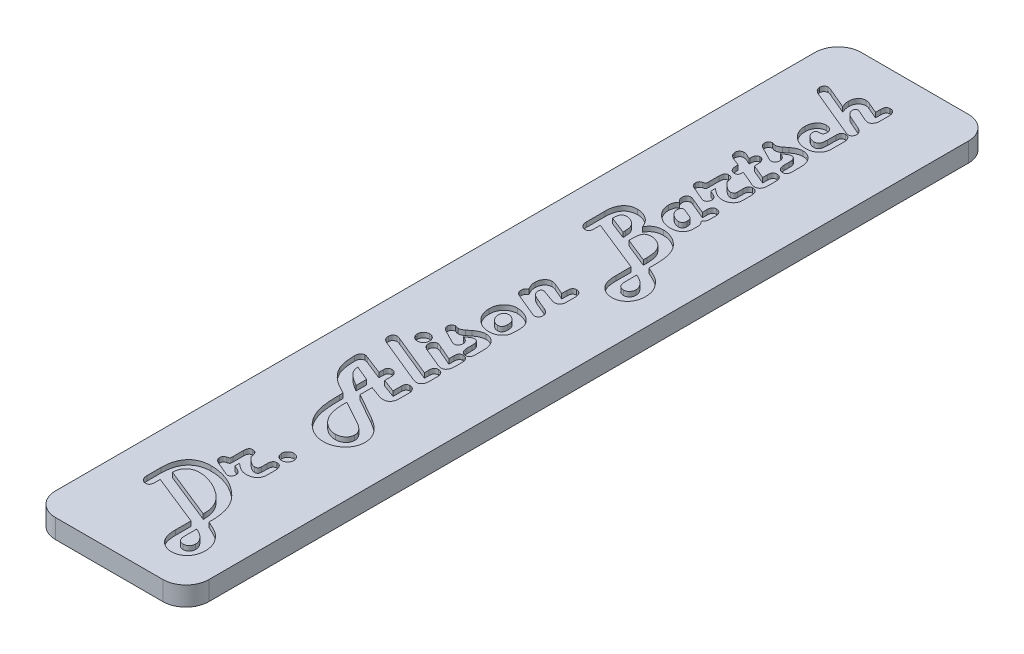
from build123d import *

# Parameters (mm, degrees)
BOSS_EXTRUDE1_DEPTH      = 66.675
BOSS_EXTRUDE1_DEPTH_BACK = 66.675
SKETCH3_W                = 25.4
SKETCH3_H                = 3.175
SKETCH5_OUTSIDE_W        = 54.556
SKETCH5_OUTSIDE_H        = 162.506
CUT_EXTRUDE2_DEPTH       = 68.947967225
CUT_EXTRUDE1_DEPTH       = 0.79375


with BuildPart() as part:
    # Sketch3 → Boss-Extrude1 (new, two sides: drawn at the far end of the back side and taken through both)
    with BuildSketch(Plane.XY.offset(-BOSS_EXTRUDE1_DEPTH_BACK)):
        Rectangle(SKETCH3_W, SKETCH3_H)
    extrude(amount=BOSS_EXTRUDE1_DEPTH + BOSS_EXTRUDE1_DEPTH_BACK)

    # Sketch5 outside → Cut-Extrude2 (cut, through all)
    with BuildSketch(Plane(origin=(0, 1.5875, 0), x_dir=(1, 0, 0), z_dir=(0, 1, 0))):
        Rectangle(SKETCH5_OUTSIDE_W, SKETCH5_OUTSIDE_H)
        with BuildLine():
            Line((12.7, -62.865), (12.7, 62.865))
            ThreePointArc((12.7, 62.865), (11.584076836, 65.559076836), (8.89, 66.675))
            Line((8.89, 66.675), (-8.89, 66.675))
            ThreePointArc((-8.89, 66.675), (-11.584076836, 65.559076836), (-12.7, 62.865))
            Line((-12.7, 62.865), (-12.7, -62.865))
            ThreePointArc((-12.7, -62.865), (-11.584076836, -65.559076836), (-8.89, -66.675))
            Line((-8.89, -66.675), (8.89, -66.675))
            ThreePointArc((8.89, -66.675), (11.584076836, -65.559076836), (12.7, -62.865))
        make_face(mode=Mode.SUBTRACT)
    extrude(amount=-CUT_EXTRUDE2_DEPTH, mode=Mode.SUBTRACT)

    # Sketch4 → Cut-Extrude1 (cut)
    # profile 1 of 17: a face of its own
    with BuildSketch(Plane(origin=(0, 1.5875, 0), x_dir=(1, 0, 0), z_dir=(0, 1, 0))):
        with BuildLine():
            Line((-5.679178082, -52.547089041), (-5.679178082, -53.261986301))
            Line((-5.679178082, -53.261986301), (-5.679178082, -53.456763699))
            add(Edge.make_bspline(
                [(-5.679178082, -53.456763699), (-5.681139035, -53.523949673), (-5.684812377, -53.649805395), (-5.713924446, -53.82601978), (-5.764512562, -53.976777914), (-5.837559677, -54.101390101), (-5.932023683, -54.200259894), (-6.050370432, -54.267463662), (-6.187957449, -54.309295364), (-6.286731391, -54.313085125), (-6.338424658, -54.315068493)],
                knots=[0, 0, 0, 0, 1.305737749, 2.445965353, 3.459324035, 4.379959175, 5.233349143, 6.085046436, 6.997810513, 8, 8, 8, 8], degree=3))
            add(Edge.make_bspline(
                [(-6.338424658, -54.315068493), (-6.405985442, -54.311052487), (-6.539317941, -54.303126821), (-6.730590117, -54.236598807), (-6.900338749, -54.122861651), (-7.049639341, -53.973110833), (-7.170453869, -53.791439606), (-7.259374763, -53.586473444), (-7.314351235, -53.361873729), (-7.320079852, -53.205225572), (-7.323013699, -53.125)],
                knots=[0, 0, 0, 0, 0.941902933, 1.858863449, 2.78744378, 3.773831386, 4.79357467, 5.815409039, 6.881186575, 8, 8, 8, 8], degree=3))
            Line((-7.323013699, -53.125), (-7.323013699, -52.930222603))
            Line((-7.323013699, -52.930222603), (-7.323013699, -50.813356164))
            add(Edge.make_bspline(
                [(-7.323013699, -50.813356164), (-7.320475549, -50.639157173), (-7.3155453, -50.300782964), (-7.267820653, -49.809276985), (-7.18958523, -49.348935759), (-7.078704255, -48.919899324), (-6.936975313, -48.521603939), (-6.766991285, -48.152545232), (-6.559923115, -47.817478931), (-6.323501854, -47.513447344), (-6.057697159, -47.242504728), (-5.762245196, -47.007493915), (-5.438747353, -46.809183229), (-5.08679158, -46.648728704), (-4.708155717, -46.521752076), (-4.301971757, -46.433234602), (-3.868472678, -46.378355859), (-3.570331213, -46.372750327), (-3.416763699, -46.369863014)],
                knots=[0, 0, 0, 0, 1.240121913, 2.408884614, 3.512215636, 4.562072732, 5.559962685, 6.519078054, 7.449661058, 8.358196616, 9.256317547, 10.145746268, 11.039719344, 11.951275398, 12.894325228, 13.877939151, 14.906963136, 16, 16, 16, 16], degree=3))
            add(Edge.make_bspline(
                [(-3.416763699, -46.369863014), (-3.178865588, -46.375320473), (-2.706260316, -46.38616219), (-2.005222822, -46.482575544), (-1.318852245, -46.633315801), (-0.648003468, -46.847092603), (0.007875584, -47.119519607), (0.646543553, -47.456420977), (1.273595063, -47.849461249), (1.667793593, -48.155734307), (1.867910959, -48.311215753)],
                knots=[0, 0, 0, 0, 0.99369571, 1.974062893, 2.951324249, 3.9272385, 4.912259598, 5.915104549, 6.941589699, 8, 8, 8, 8], degree=3))
            add(Edge.make_bspline(
                [(1.867910959, -48.311215753), (1.978197285, -48.402683462), (2.196111311, -48.583413906), (2.499418667, -48.873431537), (2.779873067, -49.170904715), (3.039382379, -49.476277741), (3.273370418, -49.792375734), (3.486715378, -50.116201656), (3.675652207, -50.449664991), (3.843402214, -50.793292257), (3.989712633, -51.149924664), (4.113540628, -51.522990299), (4.220514455, -51.912240015), (4.308869798, -52.319373584), (4.373145314, -52.743547785), (4.424054428, -53.183885948), (4.450629208, -53.641938587), (4.455387373, -53.953310474), (4.457808219, -54.111729452)],
                knots=[0, 0, 0, 0, 1.041972891, 2.058827374, 3.050103684, 4.014970579, 4.971989252, 5.909071109, 6.834104011, 7.757898592, 8.688895906, 9.635856426, 10.615406742, 11.624176682, 12.664286734, 13.734882699, 14.847559518, 16, 16, 16, 16], degree=3))
            Line((4.457808219, -54.111729452), (4.457808219, -54.62114726))
            Line((4.457808219, -54.62114726), (4.663287671, -54.70890411))
            add(Edge.make_bspline(
                [(4.663287671, -54.70890411), (4.755305177, -54.7503263), (4.932339916, -54.830019469), (5.188267535, -54.944425241), (5.420463771, -55.056703013), (5.633030062, -55.158796039), (5.82373241, -55.254829332), (5.99217766, -55.345256857), (6.141385488, -55.425452452), (6.310069605, -55.529151551), (6.506008189, -55.663304475), (6.734132992, -55.838710741), (6.95674715, -56.038198118), (7.097822135, -56.184176354), (7.169708904, -56.258561644)],
                knots=[0, 0, 0, 0, 1.222800361, 2.352575644, 3.396669397, 4.347862466, 5.210067408, 5.983579217, 6.664594993, 7.262130753, 8.381971782, 9.540587582, 10.746771362, 12, 12, 12, 12], degree=3))
            add(Edge.make_bspline(
                [(7.169708904, -56.258561644), (7.259252012, -56.359827818), (7.435529099, -56.559183267), (7.665799852, -56.879748158), (7.858042816, -57.212548791), (8.019190077, -57.554645663), (8.140760579, -57.90958419), (8.228695229, -58.275701765), (8.284253944, -58.652692555), (8.290354057, -58.90820056), (8.293424658, -59.036815068)],
                knots=[0, 0, 0, 0, 1.055914228, 2.078702545, 3.078046045, 4.055880218, 5.029205391, 6.004237832, 6.995397536, 8, 8, 8, 8], degree=3))
            add(Edge.make_bspline(
                [(8.293424658, -59.036815068), (8.290620622, -59.141770649), (8.285111992, -59.347959699), (8.251873776, -59.649825124), (8.191027588, -59.936871799), (8.107560104, -60.209939084), (8.000632184, -60.469688018), (7.869465324, -60.714966415), (7.714553896, -60.945154347), (7.537138339, -61.15855686), (7.341577706, -61.35227523), (7.131886859, -61.522305225), (6.908215426, -61.664966143), (6.672939661, -61.78395975), (6.422108099, -61.872851237), (6.160276549, -61.94047033), (5.884472994, -61.979082607), (5.696509044, -61.983865608), (5.600787671, -61.98630137)],
                knots=[0, 0, 0, 0, 1.126201464, 2.212463691, 3.25287726, 4.269850786, 5.272053028, 6.261782411, 7.249022054, 8.243830034, 9.23438794, 10.19795826, 11.134388982, 12.075812372, 13.02018767, 13.98375799, 14.973220915, 16, 16, 16, 16], degree=3))
            add(Edge.make_bspline(
                [(5.600787671, -61.98630137), (5.481962949, -61.982759456), (5.246551589, -61.975742339), (4.901392086, -61.901992344), (4.565645333, -61.794378471), (4.247078567, -61.637350478), (3.950050697, -61.444179136), (3.685416052, -61.215852768), (3.453108861, -60.95620476), (3.329976245, -60.760370195), (3.267739726, -60.661386986)],
                knots=[0, 0, 0, 0, 1.014242392, 2.009381349, 3.004557683, 4.021967388, 5.035219112, 6.025505851, 7.00200576, 8, 8, 8, 8], degree=3))
            add(Edge.make_bspline(
                [(3.267739726, -60.661386986), (3.230782911, -60.592801306), (3.155401117, -60.452905277), (3.064407715, -60.22659379), (2.987950753, -59.983714218), (2.922935082, -59.723736272), (2.875444298, -59.445951923), (2.838346721, -59.151090524), (2.817034776, -58.838788539), (2.815010595, -58.624461078), (2.813972603, -58.514554795)],
                knots=[0, 0, 0, 0, 0.84245226, 1.718372183, 2.633912599, 3.596293803, 4.615457363, 5.681185209, 6.810920853, 8, 8, 8, 8], degree=3))
            Line((2.813972603, -58.514554795), (2.813972603, -55.950342466))
            Line((2.813972603, -55.950342466), (-5.679178082, -52.547089041))
        make_face()
        with BuildLine():
            Line((2.813972603, -53.919092466), (2.813972603, -53.630136986))
            add(Edge.make_bspline(
                [(2.813972603, -53.630136986), (2.812229985, -53.537331796), (2.808779397, -53.353566676), (2.784155566, -53.080635511), (2.746792266, -52.81302123), (2.6903681, -52.551610124), (2.619740112, -52.296438761), (2.534172231, -52.046551133), (2.430309071, -51.802800051), (2.314188361, -51.562708031), (2.17712634, -51.331160796), (2.028104247, -51.103947852), (1.861775087, -50.883412999), (1.683460875, -50.666142178), (1.483489685, -50.459357167), (1.273647666, -50.252650042), (1.042967987, -50.056283056), (0.88166229, -49.930893682), (0.79984589, -49.867294521)],
                knots=[0, 0, 0, 0, 1.003752549, 1.98754731, 2.96218803, 3.924869515, 4.877913061, 5.824875223, 6.779479857, 7.742439712, 8.707376773, 9.687714611, 10.680189018, 11.694008127, 12.725763052, 13.790025714, 14.879071578, 16, 16, 16, 16], degree=3))
            add(Edge.make_bspline(
                [(0.79984589, -49.867294521), (0.637495563, -49.749110758), (0.31362577, -49.513348065), (-0.202532711, -49.206855048), (-0.736886345, -48.935205923), (-1.286214939, -48.707190397), (-1.833665188, -48.521493208), (-2.367354317, -48.387270321), (-2.880398896, -48.303197438), (-3.216699298, -48.292754037), (-3.380376712, -48.287671233)],
                knots=[0, 0, 0, 0, 1.061151743, 2.116872814, 3.169496409, 4.227969904, 5.258553914, 6.222792805, 7.135033211, 8, 8, 8, 8], degree=3))
            add(Edge.make_bspline(
                [(-3.380376712, -48.287671233), (-3.46678892, -48.289064526), (-3.635806387, -48.291789729), (-3.882804511, -48.320429966), (-4.115991615, -48.366143192), (-4.334080712, -48.433833417), (-4.538944612, -48.516949874), (-4.730305436, -48.619658868), (-4.906157833, -48.742640766), (-5.067898235, -48.881610923), (-5.2103847, -49.038883501), (-5.338824533, -49.207693498), (-5.442726671, -49.393045698), (-5.529114219, -49.590250184), (-5.598907159, -49.80052743), (-5.64329496, -50.02570101), (-5.675977303, -50.263034049), (-5.678092042, -50.425818586), (-5.679178082, -50.509417808)],
                knots=[0, 0, 0, 0, 1.145531499, 2.240595844, 3.292755274, 4.292422607, 5.264114043, 6.220902991, 7.165828125, 8.104908158, 9.042461542, 9.975419986, 10.911970153, 11.852526766, 12.827988561, 13.843075609, 14.892295267, 16, 16, 16, 16], degree=3))
            Line((-5.679178082, -50.509417808), (2.813972603, -53.919092466))
        make_face(mode=Mode.SUBTRACT)
        with BuildLine():
            Line((4.457808219, -56.650256849), (4.457808219, -58.565924658))
            add(Edge.make_bspline(
                [(4.457808219, -58.565924658), (4.460994809, -58.673142752), (4.466957488, -58.873766965), (4.512836115, -59.154524967), (4.591499209, -59.394305145), (4.709872635, -59.589943321), (4.858337145, -59.746782704), (5.044659494, -59.855311006), (5.262554621, -59.921088849), (5.418357057, -59.927919318), (5.500188356, -59.931506849)],
                knots=[0, 0, 0, 0, 1.31364871, 2.458071474, 3.475829816, 4.38621616, 5.23967168, 6.094559773, 6.99921559, 8, 8, 8, 8], degree=3))
            add(Edge.make_bspline(
                [(5.500188356, -59.931506849), (5.569155028, -59.928097386), (5.703961188, -59.921433055), (5.896015584, -59.860295981), (6.072433285, -59.765023758), (6.223360846, -59.628763412), (6.353187059, -59.469957815), (6.446221691, -59.287610202), (6.501322507, -59.087776147), (6.508778068, -58.949407296), (6.51260274, -58.878424658)],
                knots=[0, 0, 0, 0, 1.015443884, 1.984844108, 2.946375274, 3.953924431, 4.965428653, 5.959234333, 6.953095811, 8, 8, 8, 8], degree=3))
            add(Edge.make_bspline(
                [(6.51260274, -58.878424658), (6.510944819, -58.824106783), (6.507632271, -58.715578988), (6.481106386, -58.554036478), (6.436939997, -58.394839389), (6.380697586, -58.235863019), (6.301924225, -58.081075413), (6.206309798, -57.929209491), (6.098402384, -57.775904967), (5.922661518, -57.577964771), (5.670783127, -57.337441905), (5.316162311, -57.078862888), (4.909349592, -56.843849349), (4.611992169, -56.716361216), (4.457808219, -56.650256849)],
                knots=[0, 0, 0, 0, 0.609246736, 1.21728261, 1.830931323, 2.461525313, 3.105941494, 3.774613737, 4.474427454, 5.206422339, 6.740961797, 8.372497183, 10.119089455, 12, 12, 12, 12], degree=3))
        make_face(mode=Mode.SUBTRACT)
    # profile 2 of 17: a face of its own
    with BuildSketch(Plane(origin=(0, 1.5875, 0), x_dir=(1, 0, 0), z_dir=(0, 1, 0))):
        with BuildLine():
            Line((-1.43260274, -44.432791096), (-0.846130137, -44.6875))
            add(Edge.make_bspline(
                [(-0.846130137, -44.6875), (-0.784113415, -44.716218451), (-0.665976306, -44.770924901), (-0.507163435, -44.868648733), (-0.36948265, -44.968646495), (-0.257336482, -45.077892526), (-0.16943101, -45.194469987), (-0.108767407, -45.318861157), (-0.07035756, -45.449368143), (-0.065291412, -45.53912434), (-0.062739726, -45.584332192)],
                knots=[0, 0, 0, 0, 1.297501196, 2.471640463, 3.537215363, 4.524637192, 5.43567625, 6.296618738, 7.14205136, 8, 8, 8, 8], degree=3))
            add(Edge.make_bspline(
                [(-0.062739726, -45.584332192), (-0.064249291, -45.638100106), (-0.067186018, -45.742700893), (-0.105649348, -45.891396308), (-0.163102956, -46.028250923), (-0.246876118, -46.145698988), (-0.34425513, -46.245991591), (-0.457491489, -46.318635178), (-0.583595576, -46.360674955), (-0.671025425, -46.366762048), (-0.715565068, -46.369863014)],
                knots=[0, 0, 0, 0, 1.131994738, 2.202197021, 3.220602635, 4.248319073, 5.22801886, 6.155513921, 7.060358075, 8, 8, 8, 8], degree=3))
            add(Edge.make_bspline(
                [(-0.715565068, -46.369863014), (-0.747081309, -46.367071128), (-0.820370025, -46.360578802), (-0.942225513, -46.327975634), (-1.090708332, -46.274855223), (-1.198044875, -46.231203769), (-1.257089041, -46.207191781)],
                knots=[0, 0, 0, 0, 0.667539348, 1.552314029, 2.65356594, 4, 4, 4, 4], degree=3))
            Line((-1.257089041, -46.207191781), (-3.19630137, -45.374571918))
            add(Edge.make_bspline(
                [(-3.19630137, -45.374571918), (-3.251910738, -45.349460536), (-3.358097521, -45.30151004), (-3.500931864, -45.211866564), (-3.62350436, -45.116921038), (-3.724073706, -45.012661106), (-3.802724918, -44.901121935), (-3.856319972, -44.780146095), (-3.893260946, -44.652575472), (-3.896639037, -44.563623154), (-3.898356164, -44.518407534)],
                knots=[0, 0, 0, 0, 1.242093141, 2.371792344, 3.427691145, 4.394328043, 5.313892613, 6.192305435, 7.081125362, 8, 8, 8, 8], degree=3))
            add(Edge.make_bspline(
                [(-3.898356164, -44.518407534), (-3.896510838, -44.474803528), (-3.893007731, -44.39202709), (-3.872120133, -44.273306223), (-3.833957565, -44.168057166), (-3.779281238, -44.07603121), (-3.709475187, -43.996652376), (-3.622457216, -43.93333797), (-3.521903931, -43.879808081), (-3.447254499, -43.857820944), (-3.408202055, -43.846318493)],
                knots=[0, 0, 0, 0, 1.15314347, 2.189090296, 3.173792814, 4.095790583, 5.004376053, 5.947550008, 6.926271946, 8, 8, 8, 8], degree=3))
            Line((-3.408202055, -43.846318493), (-3.192020548, -43.786386986))
            add(Edge.make_bspline(
                [(-3.192020548, -43.786386986), (-3.166012398, -43.779452234), (-3.118375193, -43.766750362), (-3.056598309, -43.736275329), (-3.010020126, -43.700579965), (-2.976955035, -43.652420013), (-2.959433608, -43.584724723), (-2.948144639, -43.490687339), (-2.939675458, -43.365564104), (-2.939531558, -43.27127278), (-2.939452055, -43.219178082)],
                knots=[0, 0, 0, 0, 0.926850573, 1.697643703, 2.362895762, 2.92973869, 3.677374781, 4.746381598, 6.202419277, 8, 8, 8, 8], degree=3))
            Line((-2.939452055, -43.219178082), (-2.939452055, -41.528253425))
            add(Edge.make_bspline(
                [(-2.939452055, -41.528253425), (-2.937570141, -41.456779991), (-2.934050522, -41.323107965), (-2.904069677, -41.135994159), (-2.856572636, -40.976407662), (-2.788575116, -40.843180323), (-2.695673752, -40.741161411), (-2.582883881, -40.66841821), (-2.450261525, -40.62432754), (-2.35546974, -40.619147627), (-2.305890411, -40.616438356)],
                knots=[0, 0, 0, 0, 1.361355543, 2.546053047, 3.599677592, 4.524244374, 5.371169927, 6.197098625, 7.057021238, 8, 8, 8, 8], degree=3))
            add(Edge.make_bspline(
                [(-2.305890411, -40.616438356), (-2.236908431, -40.618867397), (-2.105643936, -40.623489573), (-1.923598266, -40.681647473), (-1.766736412, -40.772636532), (-1.643256267, -40.907006393), (-1.544572999, -41.074316119), (-1.478735842, -41.278780481), (-1.43796965, -41.51805966), (-1.434471998, -41.689303599), (-1.43260274, -41.780821918)],
                knots=[0, 0, 0, 0, 0.994284648, 1.892005291, 2.734571892, 3.588753721, 4.500369607, 5.525254763, 6.677415825, 8, 8, 8, 8], degree=3))
            Line((-1.43260274, -41.780821918), (-1.361969178, -41.855736301))
            add(Edge.make_bspline(
                [(-1.361969178, -41.855736301), (-1.275640685, -41.941380624), (-1.110395067, -42.105316636), (-0.863701621, -42.327332051), (-0.631112245, -42.514724523), (-0.416532555, -42.670873912), (-0.213839595, -42.789789724), (-0.028186714, -42.876591579), (0.143696282, -42.933748715), (0.25510596, -42.941538491), (0.30755137, -42.945205479)],
                knots=[0, 0, 0, 0, 1.435762249, 2.748263184, 3.91660617, 4.961556361, 5.879059361, 6.685751502, 7.381325737, 8, 8, 8, 8], degree=3))
            add(Edge.make_bspline(
                [(0.30755137, -42.945205479), (0.353486324, -42.944297662), (0.440770679, -42.942572653), (0.561359469, -42.909962283), (0.668100093, -42.868148281), (0.75127153, -42.797744993), (0.818376722, -42.711551586), (0.864001338, -42.605508561), (0.892910502, -42.48154968), (0.89503041, -42.393167474), (0.896164384, -42.345890411)],
                knots=[0, 0, 0, 0, 1.140484469, 2.167117703, 3.098941929, 3.971150526, 4.846255631, 5.80154673, 6.824011975, 8, 8, 8, 8], degree=3))
            Line((0.896164384, -42.345890411), (0.896164384, -41.434075342))
            add(Edge.make_bspline(
                [(0.896164384, -41.434075342), (0.898182521, -41.359078837), (0.901949312, -41.219100155), (0.930142152, -41.022575744), (0.983520387, -40.856390344), (1.055151224, -40.717886726), (1.150718895, -40.610176602), (1.267698419, -40.532950323), (1.407306267, -40.486777362), (1.50724529, -40.481973204), (1.559691781, -40.479452055)],
                knots=[0, 0, 0, 0, 1.364190584, 2.546219988, 3.596843527, 4.525897283, 5.362221888, 6.186477391, 7.048290713, 8, 8, 8, 8], degree=3))
            add(Edge.make_bspline(
                [(1.559691781, -40.479452055), (1.633666212, -40.483326789), (1.775914151, -40.490777645), (1.975742682, -40.554464503), (2.149287601, -40.660197076), (2.291023797, -40.810086737), (2.40652937, -40.994322611), (2.482997056, -41.215352287), (2.533984606, -41.465988798), (2.537926761, -41.64425883), (2.54, -41.738013699)],
                knots=[0, 0, 0, 0, 0.982615473, 1.889504555, 2.759142238, 3.658944971, 4.610088785, 5.631441668, 6.75433984, 8, 8, 8, 8], degree=3))
            Line((2.54, -41.738013699), (2.54, -43.154965753))
            add(Edge.make_bspline(
                [(2.54, -43.154965753), (2.5383024, -43.211423041), (2.534977996, -43.321983129), (2.510384601, -43.483928878), (2.472968238, -43.638738689), (2.416521678, -43.784930791), (2.344926398, -43.923050288), (2.259558563, -44.054759689), (2.155710436, -44.176577704), (2.038215237, -44.289992729), (1.907947493, -44.391797383), (1.768882381, -44.482577944), (1.61926785, -44.557709551), (1.461132501, -44.620062111), (1.292391004, -44.666943522), (1.114822727, -44.700559783), (0.928132827, -44.723123216), (0.800627218, -44.725046857), (0.735633562, -44.726027397)],
                knots=[0, 0, 0, 0, 1.009407673, 1.976719137, 2.923785669, 3.852797958, 4.771676065, 5.702527031, 6.65345443, 7.628144937, 8.618662201, 9.606215811, 10.593522047, 11.607757909, 12.641947342, 13.720607507, 14.838121302, 16, 16, 16, 16], degree=3))
            add(Edge.make_bspline(
                [(0.735633562, -44.726027397), (0.651262954, -44.722991744), (0.482172253, -44.716907862), (0.230972093, -44.672231385), (-0.017070175, -44.601930809), (-0.265153047, -44.497664585), (-0.523447633, -44.355371092), (-0.803548993, -44.171618671), (-1.111236787, -43.943879857), (-1.32133514, -43.772349126), (-1.43260274, -43.681506849)],
                knots=[0, 0, 0, 0, 0.822710096, 1.64882809, 2.481516469, 3.333299355, 4.267584386, 5.354441073, 6.598918144, 8, 8, 8, 8], degree=3))
            Line((-1.43260274, -43.681506849), (-1.43260274, -44.432791096))
        make_face()
    # profile 3 of 17: a face of its own
    with BuildSketch(Plane(origin=(0, 1.5875, 0), x_dir=(1, 0, 0), z_dir=(0, 1, 0))):
        with BuildLine():
            add(Edge.make_bspline(
                [(0.622191781, -38.762842466), (0.625798096, -38.694643934), (0.632835998, -38.561551107), (0.691439504, -38.369734178), (0.787228625, -38.193306804), (0.920147512, -38.037681759), (1.075772557, -37.904762872), (1.252199931, -37.80897375), (1.44401686, -37.750370245), (1.577109688, -37.743332342), (1.645308219, -37.739726027)],
                knots=[0, 0, 0, 0, 1.018015329, 1.986707578, 2.970091954, 4, 5.029908046, 6.013292422, 6.981984671, 8, 8, 8, 8], degree=3))
            add(Edge.make_bspline(
                [(1.645308219, -37.739726027), (1.714197217, -37.743412916), (1.849331034, -37.75064518), (2.044134079, -37.808530729), (2.223061144, -37.904139368), (2.378993595, -38.037739937), (2.511958868, -38.193291997), (2.607736163, -38.369737978), (2.66634272, -38.561550106), (2.673380202, -38.694643595), (2.676986301, -38.762842466)],
                knots=[0, 0, 0, 0, 1.023458974, 2.007634331, 2.995409192, 4.02013336, 5.044857529, 6.023292197, 6.987108688, 8, 8, 8, 8], degree=3))
            add(Edge.make_bspline(
                [(2.676986301, -38.762842466), (2.673299631, -38.831731808), (2.666067797, -38.966866301), (2.608179119, -39.161664422), (2.512582459, -39.340610341), (2.378935452, -39.496469698), (2.223076095, -39.630116706), (2.044130175, -39.725713366), (1.849332054, -39.783602044), (1.714197562, -39.790833878), (1.645308219, -39.794520548)],
                knots=[0, 0, 0, 0, 1.018333356, 1.997579833, 2.980407786, 4, 5.019592214, 6.002420167, 6.981666644, 8, 8, 8, 8], degree=3))
            add(Edge.make_bspline(
                [(1.645308219, -39.794520548), (1.577109349, -39.790914449), (1.44401586, -39.783876966), (1.252203731, -39.72527041), (1.07575775, -39.629493115), (0.92020569, -39.496527842), (0.786605121, -39.340595391), (0.690996483, -39.161668325), (0.633110933, -38.966865281), (0.62587867, -38.831731464), (0.622191781, -38.762842466)],
                knots=[0, 0, 0, 0, 1.012891312, 1.976707803, 2.955142471, 3.97986664, 5.004590808, 5.992365669, 6.976541026, 8, 8, 8, 8], degree=3))
        make_face()
    # profile 4 of 17: a face of its own
    with BuildSketch(Plane(origin=(0, 1.5875, 0), x_dir=(1, 0, 0), z_dir=(0, 1, 0))):
        with BuildLine():
            Line((-1.295616438, -21.840753425), (-1.295616438, -23.842037671))
            Line((-1.295616438, -23.842037671), (2.948818493, -26.241438356))
            add(Edge.make_bspline(
                [(2.948818493, -26.241438356), (3.071585592, -26.311529262), (3.31176096, -26.448651581), (3.652010486, -26.671476063), (3.971356746, -26.894212255), (4.265287908, -27.124898887), (4.53827465, -27.357424878), (4.786750676, -27.596541924), (5.009648761, -27.842315466), (5.21301187, -28.089439636), (5.387604309, -28.34603534), (5.543640645, -28.604014449), (5.671808431, -28.869866311), (5.780421409, -29.138730223), (5.86053387, -29.414543616), (5.922188279, -29.693078596), (5.956211822, -29.977756737), (5.961827167, -30.169010902), (5.964657534, -30.265410959)],
                knots=[0, 0, 0, 0, 1.284127512, 2.512202389, 3.693820525, 4.820683154, 5.905595552, 6.95085666, 7.951169987, 8.919030195, 9.855848477, 10.768583501, 11.655730142, 12.534476643, 13.400021201, 14.262063092, 15.124007484, 16, 16, 16, 16], degree=3))
            add(Edge.make_bspline(
                [(5.964657534, -30.265410959), (5.961153186, -30.382575338), (5.954286446, -30.612157895), (5.906432562, -30.950195112), (5.825636301, -31.273182884), (5.710631168, -31.582084714), (5.565628615, -31.876388143), (5.384513119, -32.154533703), (5.175684571, -32.420693456), (4.933501689, -32.666815422), (4.670257339, -32.893077025), (4.387379054, -33.091095199), (4.087619823, -33.25506673), (3.775443027, -33.395667561), (3.444807893, -33.497768748), (3.101012618, -33.576610627), (2.740975712, -33.621771751), (2.495886972, -33.627311879), (2.370907534, -33.630136986)],
                knots=[0, 0, 0, 0, 1.023509052, 2.005556865, 2.976162568, 3.926806602, 4.88020563, 5.83639235, 6.821600422, 7.8310613, 8.847943164, 9.850897116, 10.841415261, 11.829399931, 12.83678008, 13.859073563, 14.908265711, 16, 16, 16, 16], degree=3))
            add(Edge.make_bspline(
                [(2.370907534, -33.630136986), (2.268043807, -33.628479773), (2.062373347, -33.625166264), (1.755746022, -33.585787304), (1.451338298, -33.52949664), (1.149767167, -33.446496627), (0.850918077, -33.342823007), (0.555660023, -33.212061333), (0.262670881, -33.060848869), (-0.02488, -32.885370314), (-0.304733769, -32.69057701), (-0.575520857, -32.479117407), (-0.831396054, -32.247261697), (-1.076541232, -32.000104391), (-1.310118878, -31.736904041), (-1.530648623, -31.455820054), (-1.739079532, -31.157649173), (-1.866752789, -30.948892405), (-1.931318493, -30.843321918)],
                knots=[0, 0, 0, 0, 0.920360802, 1.840211654, 2.763493683, 3.690106123, 4.637553702, 5.592892168, 6.578521632, 7.587450506, 8.606298991, 9.629842057, 10.661069622, 11.695398393, 12.745173504, 13.809615302, 14.892299487, 16, 16, 16, 16], degree=3))
            add(Edge.make_bspline(
                [(-1.931318493, -30.843321918), (-2.019890413, -30.679242233), (-2.198010996, -30.349273447), (-2.4129951, -29.824130493), (-2.585860962, -29.273761957), (-2.69854726, -28.794780153), (-2.769533144, -28.389947112), (-2.81256929, -28.059023147), (-2.855453955, -27.704759129), (-2.882339586, -27.325336551), (-2.910023765, -26.922384688), (-2.925547909, -26.494813078), (-2.936765563, -26.043153567), (-2.938541589, -25.734169028), (-2.939452055, -25.575770548)],
                knots=[0, 0, 0, 0, 1.235982978, 2.485595966, 3.756177378, 5.05891948, 5.745857238, 6.481327979, 7.271967052, 8.112145328, 9.003570026, 9.950725021, 10.949455392, 12, 12, 12, 12], degree=3))
            Line((-2.939452055, -25.575770548), (-2.939452055, -25.040667808))
            Line((-2.939452055, -25.040667808), (-3.975410959, -24.473458904))
            add(Edge.make_bspline(
                [(-3.975410959, -24.473458904), (-4.149557271, -24.374563951), (-4.489478673, -24.181527932), (-4.962329897, -23.858408819), (-5.394232337, -23.523250461), (-5.776467053, -23.166677596), (-6.119604297, -22.798721721), (-6.409691637, -22.408297989), (-6.663386529, -22.005966185), (-6.793798793, -21.721067053), (-6.858544521, -21.579623288)],
                knots=[0, 0, 0, 0, 1.154231185, 2.252978409, 3.298924017, 4.303170672, 5.263936639, 6.195269199, 7.104005978, 8, 8, 8, 8], degree=3))
            add(Edge.make_bspline(
                [(-6.858544521, -21.579623288), (-6.896286328, -21.485220746), (-6.97367056, -21.291661699), (-7.066466212, -20.984289314), (-7.144820551, -20.655998975), (-7.212019091, -20.307736746), (-7.25982697, -19.937306582), (-7.295510012, -19.546764859), (-7.320757521, -19.134887265), (-7.322249397, -18.853492919), (-7.323013699, -18.709332192)],
                knots=[0, 0, 0, 0, 0.833580457, 1.709138717, 2.630308376, 3.601286859, 4.616795241, 5.692327562, 6.817759698, 8, 8, 8, 8], degree=3))
            add(Edge.make_bspline(
                [(-7.323013699, -18.709332192), (-7.320583847, -18.637834378), (-7.315956282, -18.50166937), (-7.280506959, -18.309129763), (-7.2182065, -18.140555351), (-7.130333681, -17.996877942), (-7.018150883, -17.882292092), (-6.885831949, -17.796666578), (-6.73099726, -17.749703875), (-6.621971851, -17.74313833), (-6.565308219, -17.739726027)],
                knots=[0, 0, 0, 0, 1.235229773, 2.35245055, 3.366973227, 4.325000809, 5.240507286, 6.116206508, 7.020938506, 8, 8, 8, 8], degree=3))
            add(Edge.make_bspline(
                [(-6.565308219, -17.739726027), (-6.505621834, -17.744610539), (-6.373653528, -17.755410335), (-6.248553992, -17.799211307), (-6.180034247, -17.823202055)],
                knots=[0, 0, 0, 0, 0.904556353, 2, 2, 2, 2], degree=3))
            Line((-6.180034247, -17.823202055), (-6.017363014, -17.887414384))
            Line((-6.017363014, -17.887414384), (-2.939452055, -19.088184932))
            Line((-2.939452055, -19.088184932), (-2.939452055, -18.540239726))
            Line((-2.939452055, -18.540239726), (-2.939452055, -18.351883562))
            add(Edge.make_bspline(
                [(-2.939452055, -18.351883562), (-2.937730068, -18.293198646), (-2.934487007, -18.182675853), (-2.902051927, -18.028711399), (-2.85102607, -17.89649102), (-2.778046201, -17.786359057), (-2.679938322, -17.701976977), (-2.560892959, -17.644903194), (-2.423104009, -17.60652531), (-2.324019721, -17.604048805), (-2.271643836, -17.602739726)],
                knots=[0, 0, 0, 0, 1.224457869, 2.306052593, 3.269225765, 4.170438305, 5.03696607, 5.936821825, 6.909405468, 8, 8, 8, 8], degree=3))
            add(Edge.make_bspline(
                [(-2.271643836, -17.602739726), (-2.206201902, -17.606057428), (-2.077393564, -17.612587608), (-1.893383819, -17.67641775), (-1.725077022, -17.776996484), (-1.5774348, -17.914890455), (-1.45034212, -18.077479699), (-1.360360336, -18.264440183), (-1.303921877, -18.468475285), (-1.298440224, -18.61049044), (-1.295616438, -18.68364726)],
                knots=[0, 0, 0, 0, 0.967844388, 1.904993043, 2.854314898, 3.858179587, 4.884883616, 5.897857367, 6.917115065, 8, 8, 8, 8], degree=3))
            Line((-1.295616438, -18.68364726), (-1.295616438, -18.878424658))
            Line((-1.295616438, -18.878424658), (-1.295616438, -19.790239726))
            Line((-1.295616438, -19.790239726), (0.896164384, -20.590753425))
            Line((0.896164384, -20.590753425), (0.896164384, -19.413527397))
            Line((0.896164384, -19.413527397), (0.896164384, -19.225171233))
            add(Edge.make_bspline(
                [(0.896164384, -19.225171233), (0.898160062, -19.162272113), (0.901905457, -19.044225991), (0.93066785, -18.879101384), (0.982102962, -18.738614077), (1.054453212, -18.622208462), (1.151477261, -18.533368785), (1.266973882, -18.466972047), (1.40576485, -18.431837262), (1.503865126, -18.427130603), (1.555410959, -18.424657534)],
                knots=[0, 0, 0, 0, 1.273098158, 2.389290989, 3.376549181, 4.286045457, 5.134299476, 6.013945099, 6.956446832, 8, 8, 8, 8], degree=3))
            add(Edge.make_bspline(
                [(1.555410959, -18.424657534), (1.622314811, -18.42864389), (1.753457997, -18.436457842), (1.940584354, -18.50259349), (2.111823341, -18.607143087), (2.258238512, -18.754622322), (2.385557234, -18.925377988), (2.475742205, -19.121494021), (2.531413056, -19.334831664), (2.537090583, -19.483097396), (2.54, -19.559075342)],
                knots=[0, 0, 0, 0, 0.959970407, 1.881708946, 2.821665646, 3.823251842, 4.851715016, 5.871022397, 6.909017313, 8, 8, 8, 8], degree=3))
            Line((2.54, -19.559075342), (2.54, -19.75385274))
            Line((2.54, -19.75385274), (2.54, -21.299229452))
            add(Edge.make_bspline(
                [(2.54, -21.299229452), (2.536040471, -21.395891951), (2.528413047, -21.582097391), (2.465743389, -21.848053798), (2.359420533, -22.0854668), (2.214022903, -22.292068513), (2.034029431, -22.460255191), (1.825458311, -22.583437845), (1.591204765, -22.659388811), (1.4261358, -22.66721433), (1.341369863, -22.671232877)],
                knots=[0, 0, 0, 0, 1.135640793, 2.187637353, 3.190204587, 4.177136149, 5.13878535, 6.063917208, 7.005786023, 8, 8, 8, 8], degree=3))
            add(Edge.make_bspline(
                [(1.341369863, -22.671232877), (1.265522359, -22.667365431), (1.097319661, -22.658788817), (0.826048408, -22.600035489), (0.512166361, -22.508720038), (0.291424916, -22.429281794), (0.172705479, -22.386558219)],
                knots=[0, 0, 0, 0, 0.753316793, 1.670587834, 2.747192678, 4, 4, 4, 4], degree=3))
            Line((0.172705479, -22.386558219), (-1.295616438, -21.840753425))
        make_face()
        with BuildLine():
            Line((-2.939452055, -21.132277397), (-5.430890411, -20.092037671))
            add(Edge.make_bspline(
                [(-5.430890411, -20.092037671), (-5.419124767, -20.215420733), (-5.396212154, -20.455698992), (-5.297034552, -20.796928892), (-5.154382626, -21.108392963), (-4.99561144, -21.345367758), (-4.836746792, -21.521095628), (-4.698638149, -21.660339762), (-4.535935634, -21.801051664), (-4.354515003, -21.948888711), (-4.150744676, -22.100632585), (-3.924993114, -22.256297202), (-3.68010881, -22.419700713), (-3.506370066, -22.524925271), (-3.416763699, -22.579195205)],
                knots=[0, 0, 0, 0, 1.327479438, 2.585155888, 3.790872231, 4.992669277, 5.627155637, 6.330882107, 7.09570796, 7.933840435, 8.841788147, 9.820799051, 10.876069462, 12, 12, 12, 12], degree=3))
            Line((-3.416763699, -22.579195205), (-2.939452055, -22.874571918))
            Line((-2.939452055, -22.874571918), (-2.939452055, -21.132277397))
        make_face(mode=Mode.SUBTRACT)
        with BuildLine():
            Line((-1.295616438, -26.031678082), (-1.295616438, -26.643835616))
            add(Edge.make_bspline(
                [(-1.295616438, -26.643835616), (-1.293085762, -26.810141254), (-1.28814845, -27.134601003), (-1.251661846, -27.608494523), (-1.190828705, -28.056262911), (-1.102430369, -28.477218724), (-0.992724043, -28.87224487), (-0.854882318, -29.240094472), (-0.693538033, -29.582622729), (-0.563425086, -29.793477611), (-0.499383562, -29.897260274)],
                knots=[0, 0, 0, 0, 1.17507216, 2.292547767, 3.356328211, 4.36586142, 5.329840842, 6.250349605, 7.138822986, 8, 8, 8, 8], degree=3))
            add(Edge.make_bspline(
                [(-0.499383562, -29.897260274), (-0.412374077, -30.020849943), (-0.239832842, -30.265930285), (0.06803343, -30.590697147), (0.403408288, -30.880561943), (0.766946255, -31.126693476), (1.147534891, -31.326873078), (1.537259268, -31.4679542), (1.928589302, -31.559666362), (2.191339838, -31.570144668), (2.321678082, -31.575342466)],
                knots=[0, 0, 0, 0, 1.061931571, 2.105827722, 3.137883091, 4.174868311, 5.187188109, 6.15404082, 7.084306037, 8, 8, 8, 8], degree=3))
            add(Edge.make_bspline(
                [(2.321678082, -31.575342466), (2.436312103, -31.570045027), (2.660754229, -31.559673165), (2.984392523, -31.476721237), (3.280567651, -31.336907087), (3.502067293, -31.177631941), (3.65905773, -31.029025046), (3.763682595, -30.910991191), (3.849271509, -30.784816174), (3.922728807, -30.655269647), (3.979369306, -30.518821782), (4.017306634, -30.376209594), (4.04158813, -30.228420444), (4.045085323, -30.127805296), (4.046849315, -30.077054795)],
                knots=[0, 0, 0, 0, 1.625345399, 3.182266278, 4.704124598, 6.249545861, 7.030225429, 7.76935358, 8.482720177, 9.189807842, 9.879872433, 10.572531956, 11.279981989, 12, 12, 12, 12], degree=3))
            add(Edge.make_bspline(
                [(4.046849315, -30.077054795), (4.042352195, -29.987406975), (4.033360239, -29.808156894), (3.958832924, -29.544977781), (3.838160835, -29.291968521), (3.673618852, -29.045009685), (3.458299218, -28.810248116), (3.198205244, -28.58199836), (2.891614513, -28.361989677), (2.664639513, -28.230087354), (2.546421233, -28.161386986)],
                knots=[0, 0, 0, 0, 0.841394824, 1.682362055, 2.549233927, 3.467926034, 4.460234473, 5.5338279, 6.715512172, 8, 8, 8, 8], degree=3))
            Line((2.546421233, -28.161386986), (-1.295616438, -26.031678082))
        make_face(mode=Mode.SUBTRACT)
    # profile 5 of 17: a face of its own
    with BuildSketch(Plane(origin=(0, 1.5875, 0), x_dir=(1, 0, 0), z_dir=(0, 1, 0))):
        with BuildLine():
            Line((0.896164384, -15.398116438), (0.896164384, -14.640410959))
            add(Edge.make_bspline(
                [(0.896164384, -14.640410959), (0.897834529, -14.571738634), (0.900970061, -14.442813237), (0.933677638, -14.26369597), (0.982506229, -14.10948604), (1.059701894, -13.984784636), (1.155324812, -13.884156579), (1.274884874, -13.814833007), (1.414912172, -13.772539774), (1.515126473, -13.768999895), (1.568253425, -13.767123288)],
                knots=[0, 0, 0, 0, 1.309866294, 2.459142491, 3.467464394, 4.378877924, 5.236448562, 6.091742891, 6.988369101, 8, 8, 8, 8], degree=3))
            add(Edge.make_bspline(
                [(1.568253425, -13.767123288), (1.640683327, -13.770580023), (1.780230588, -13.77723995), (1.977843737, -13.835126647), (2.147078575, -13.937752173), (2.291125794, -14.075142947), (2.405297026, -14.248504953), (2.482999164, -14.454787523), (2.534062191, -14.6893036), (2.537949856, -14.856289828), (2.54, -14.944349315)],
                knots=[0, 0, 0, 0, 1.005327757, 1.936917359, 2.82618379, 3.730792979, 4.682219187, 5.683775513, 6.778548722, 8, 8, 8, 8], degree=3))
            Line((2.54, -14.944349315), (2.54, -16.243578767))
            add(Edge.make_bspline(
                [(2.54, -16.243578767), (2.537639119, -16.333001279), (2.533144337, -16.503248981), (2.485453616, -16.744580321), (2.407171509, -16.95775856), (2.295685709, -17.139037443), (2.157821394, -17.285377199), (1.995028013, -17.392516488), (1.807793797, -17.453218732), (1.676410899, -17.461499634), (1.608921233, -17.465753425)],
                knots=[0, 0, 0, 0, 1.241432907, 2.363511102, 3.402225189, 4.381846537, 5.300609504, 6.175237008, 7.062643248, 8, 8, 8, 8], degree=3))
            add(Edge.make_bspline(
                [(1.608921233, -17.465753425), (1.565198663, -17.462737736), (1.464210134, -17.455772227), (1.296766992, -17.409166744), (1.091639573, -17.3436017), (0.944351279, -17.285517103), (0.864058219, -17.25385274)],
                knots=[0, 0, 0, 0, 0.674748729, 1.558505876, 2.669038612, 4, 4, 4, 4], degree=3))
            Line((0.864058219, -17.25385274), (-6.319160959, -14.293664384))
            Line((-6.319160959, -14.293664384), (-6.513938356, -14.214469178))
            add(Edge.make_bspline(
                [(-6.513938356, -14.214469178), (-6.578425905, -14.186366158), (-6.70216819, -14.132440525), (-6.865476208, -14.02460015), (-7.00740762, -13.909972222), (-7.122124587, -13.779213772), (-7.213926715, -13.637888764), (-7.276252948, -13.481417191), (-7.316120585, -13.313931387), (-7.320686475, -13.197292852), (-7.323013699, -13.137842466)],
                knots=[0, 0, 0, 0, 1.172289605, 2.249454275, 3.256072104, 4.209702834, 5.141584597, 6.05516676, 7.008723089, 8, 8, 8, 8], degree=3))
            add(Edge.make_bspline(
                [(-7.323013699, -13.137842466), (-7.320499618, -13.088382366), (-7.315581844, -12.991633834), (-7.278156425, -12.851870118), (-7.215502316, -12.723426958), (-7.127412288, -12.611320534), (-7.023586169, -12.516934739), (-6.906186331, -12.446556334), (-6.777215679, -12.403945121), (-6.687624106, -12.399503933), (-6.642363014, -12.397260274)],
                knots=[0, 0, 0, 0, 1.061210962, 2.075826869, 3.083127833, 4.109819504, 5.118866931, 6.080623096, 7.030343019, 8, 8, 8, 8], degree=3))
            add(Edge.make_bspline(
                [(-6.642363014, -12.397260274), (-6.605156139, -12.398396683), (-6.528017059, -12.400752742), (-6.409359417, -12.424718194), (-6.283215601, -12.458214448), (-6.198342714, -12.489964017), (-6.154349315, -12.506421233)],
                knots=[0, 0, 0, 0, 0.886930248, 1.83882642, 2.879767429, 4, 4, 4, 4], degree=3))
            Line((-6.154349315, -12.506421233), (-5.961712329, -12.585616438))
            Line((-5.961712329, -12.585616438), (0.896164384, -15.398116438))
        make_face()
    # profile 6 of 17: a face of its own
    with BuildSketch(Plane(origin=(0, 1.5875, 0), x_dir=(1, 0, 0), z_dir=(0, 1, 0))):
        with BuildLine():
            Line((0.896164384, -11.352739726), (0.896164384, -10.537243151))
            add(Edge.make_bspline(
                [(0.896164384, -10.537243151), (0.897911977, -10.468589636), (0.9012108, -10.338996633), (0.933240067, -10.158968127), (0.983136891, -10.003838445), (1.059002759, -9.877660453), (1.155345459, -9.77657725), (1.27525604, -9.707933504), (1.414473739, -9.662215234), (1.515047985, -9.659153797), (1.568253425, -9.657534247)],
                knots=[0, 0, 0, 0, 1.305122279, 2.463598793, 3.468268802, 4.38797846, 5.242443187, 6.094639849, 6.99203298, 8, 8, 8, 8], degree=3))
            add(Edge.make_bspline(
                [(1.568253425, -9.657534247), (1.640767906, -9.660737905), (1.780687093, -9.666919474), (1.977354082, -9.728347982), (2.1479285, -9.830007851), (2.290358018, -9.969938844), (2.405954482, -10.143541638), (2.483196345, -10.352409525), (2.533869892, -10.589750702), (2.537889692, -10.758836399), (2.54, -10.84760274)],
                knots=[0, 0, 0, 0, 0.999294106, 1.928172372, 2.812101714, 3.718114382, 4.663830439, 5.668552371, 6.776040317, 8, 8, 8, 8], degree=3))
            Line((2.54, -10.84760274), (2.54, -11.997003425))
            add(Edge.make_bspline(
                [(2.54, -11.997003425), (2.536679608, -12.097075549), (2.530377234, -12.287020577), (2.484347925, -12.556457019), (2.403648828, -12.7929137), (2.290437308, -12.99342394), (2.150578635, -13.156997042), (1.98186689, -13.273624981), (1.788093219, -13.343013724), (1.651585928, -13.351686111), (1.58109589, -13.356164384)],
                knots=[0, 0, 0, 0, 1.28711117, 2.443041656, 3.502572821, 4.485077292, 5.389118816, 6.247116561, 7.09484088, 8, 8, 8, 8], degree=3))
            add(Edge.make_bspline(
                [(1.58109589, -13.356164384), (1.538904386, -13.353467834), (1.448081256, -13.347663132), (1.304203572, -13.31886411), (1.14555422, -13.267621252), (1.035771955, -13.224789634), (0.9775, -13.202054795)],
                knots=[0, 0, 0, 0, 0.809405691, 1.742359281, 2.801653991, 4, 4, 4, 4], degree=3))
            Line((0.9775, -13.202054795), (-1.929178082, -11.990582192))
            Line((-1.929178082, -11.990582192), (-2.130376712, -11.911386986))
            add(Edge.make_bspline(
                [(-2.130376712, -11.911386986), (-2.194627453, -11.882177818), (-2.317308281, -11.826405622), (-2.483402981, -11.722138963), (-2.622995018, -11.604445049), (-2.739361409, -11.47387592), (-2.83030191, -11.330343127), (-2.89271892, -11.171889016), (-2.932549255, -11.002255543), (-2.937121703, -10.884216762), (-2.939452055, -10.824058219)],
                knots=[0, 0, 0, 0, 1.169966962, 2.233943366, 3.241792019, 4.189384164, 5.125372702, 6.044138547, 7.003193917, 8, 8, 8, 8], degree=3))
            add(Edge.make_bspline(
                [(-2.939452055, -10.824058219), (-2.937064616, -10.77384603), (-2.932426933, -10.676307123), (-2.893706935, -10.535973924), (-2.834572001, -10.405440018), (-2.747534482, -10.291350077), (-2.647354239, -10.192746366), (-2.532337706, -10.120139898), (-2.405779486, -10.077623228), (-2.318332579, -10.071574548), (-2.273784247, -10.068493151)],
                knots=[0, 0, 0, 0, 1.078211172, 2.094462323, 3.11059759, 4.141917063, 5.162215888, 6.120373975, 7.04245663, 8, 8, 8, 8], degree=3))
            add(Edge.make_bspline(
                [(-2.273784247, -10.068493151), (-2.231500298, -10.071585503), (-2.134915908, -10.07864901), (-1.977911457, -10.12169063), (-1.789922295, -10.183194615), (-1.658305936, -10.24060398), (-1.586712329, -10.271832192)],
                knots=[0, 0, 0, 0, 0.704844091, 1.609994759, 2.699940496, 4, 4, 4, 4], degree=3))
            Line((-1.586712329, -10.271832192), (0.896164384, -11.352739726))
        make_face()
    # profile 7 of 17: a face of its own
    with BuildSketch(Plane(origin=(0, 1.5875, 0), x_dir=(1, 0, 0), z_dir=(0, 1, 0))):
        with BuildLine():
            add(Edge.make_bspline(
                [(-5.268219178, -10.410958904), (-5.26448809, -10.342098185), (-5.257169124, -10.207019839), (-5.200094008, -10.012421193), (-5.102785065, -9.835912336), (-4.97327045, -9.678510372), (-4.815868486, -9.548995757), (-4.639359629, -9.451686814), (-4.444760983, -9.394611698), (-4.309682637, -9.387292732), (-4.240821918, -9.383561644)],
                knots=[0, 0, 0, 0, 1.022434278, 2.00562427, 2.98307932, 4, 5.01692068, 5.99437573, 6.977565722, 8, 8, 8, 8], degree=3))
            add(Edge.make_bspline(
                [(-4.240821918, -9.383561644), (-4.171961198, -9.387292732), (-4.036882853, -9.394611698), (-3.842284207, -9.451686814), (-3.66577535, -9.548995757), (-3.508373386, -9.678510372), (-3.378858771, -9.835912336), (-3.281549828, -10.012421193), (-3.224474711, -10.207019839), (-3.217155746, -10.342098185), (-3.213424658, -10.410958904)],
                knots=[0, 0, 0, 0, 1.022434278, 2.00562427, 2.98307932, 4, 5.01692068, 5.99437573, 6.977565722, 8, 8, 8, 8], degree=3))
            add(Edge.make_bspline(
                [(-3.213424658, -10.410958904), (-3.217155746, -10.479819624), (-3.224474711, -10.614897969), (-3.281549828, -10.809496615), (-3.378858771, -10.986005472), (-3.508373386, -11.143407436), (-3.66577535, -11.272922051), (-3.842284207, -11.370230994), (-4.036882853, -11.427306111), (-4.171961198, -11.434625076), (-4.240821918, -11.438356164)],
                knots=[0, 0, 0, 0, 1.022434278, 2.00562427, 2.98307932, 4, 5.01692068, 5.99437573, 6.977565722, 8, 8, 8, 8], degree=3))
            add(Edge.make_bspline(
                [(-4.240821918, -11.438356164), (-4.309682637, -11.434625076), (-4.444760983, -11.427306111), (-4.639359629, -11.370230994), (-4.815868486, -11.272922051), (-4.97327045, -11.143407436), (-5.102785065, -10.986005472), (-5.200094008, -10.809496615), (-5.257169124, -10.614897969), (-5.26448809, -10.479819624), (-5.268219178, -10.410958904)],
                knots=[0, 0, 0, 0, 1.022434278, 2.00562427, 2.98307932, 4, 5.01692068, 5.99437573, 6.977565722, 8, 8, 8, 8], degree=3))
        make_face()
    # profile 8 of 17: a face of its own
    with BuildSketch(Plane(origin=(0, 1.5875, 0), x_dir=(1, 0, 0), z_dir=(0, 1, 0))):
        with BuildLine():
            Line((-1.025924658, -6.984160959), (-0.71984589, -7.125428082))
            add(Edge.make_bspline(
                [(-0.71984589, -7.125428082), (-0.667752184, -7.152760578), (-0.56757385, -7.205322087), (-0.433826196, -7.301037314), (-0.318810268, -7.403192288), (-0.225728129, -7.516225421), (-0.151459289, -7.636729481), (-0.099598907, -7.76703299), (-0.069108385, -7.90598749), (-0.064890691, -8.001417592), (-0.062739726, -8.050085616)],
                knots=[0, 0, 0, 0, 1.174117443, 2.257875999, 3.277186543, 4.239058904, 5.172954822, 6.09414408, 7.028039998, 8, 8, 8, 8], degree=3))
            add(Edge.make_bspline(
                [(-0.062739726, -8.050085616), (-0.065361076, -8.099521202), (-0.070561911, -8.19760285), (-0.107711543, -8.340892788), (-0.171324157, -8.474980506), (-0.255582217, -8.59745958), (-0.355840951, -8.701029317), (-0.467082533, -8.779035956), (-0.587743218, -8.826962706), (-0.671638576, -8.832739279), (-0.713424658, -8.835616438)],
                knots=[0, 0, 0, 0, 1.057292043, 2.097698319, 3.142574676, 4.21811325, 5.26521749, 6.20945791, 7.108177862, 8, 8, 8, 8], degree=3))
            add(Edge.make_bspline(
                [(-0.713424658, -8.835616438), (-0.757201361, -8.832855482), (-0.853470864, -8.826783852), (-1.004717076, -8.780836214), (-1.177524888, -8.717790352), (-1.294790875, -8.657951621), (-1.357688356, -8.625856164)],
                knots=[0, 0, 0, 0, 0.768398351, 1.68978755, 2.760880737, 4, 4, 4, 4], degree=3))
            Line((-1.357688356, -8.625856164), (-3.226267123, -7.664811644))
            add(Edge.make_bspline(
                [(-3.226267123, -7.664811644), (-3.279709061, -7.635180486), (-3.38149435, -7.578745108), (-3.518261478, -7.480835111), (-3.634464226, -7.378796733), (-3.730209267, -7.270308764), (-3.806737664, -7.157467989), (-3.858269725, -7.036614437), (-3.892378351, -6.911834537), (-3.896360248, -6.825991129), (-3.898356164, -6.782962329)],
                knots=[0, 0, 0, 0, 1.255163649, 2.390579383, 3.450154596, 4.426924585, 5.358385177, 6.238436701, 7.117020656, 8, 8, 8, 8], degree=3))
            add(Edge.make_bspline(
                [(-3.898356164, -6.782962329), (-3.896585461, -6.737072517), (-3.893128568, -6.647483199), (-3.85756709, -6.518593591), (-3.798666303, -6.401299957), (-3.718924749, -6.296911095), (-3.626040023, -6.207990305), (-3.519278032, -6.143653004), (-3.404641801, -6.103133639), (-3.324335537, -6.098309793), (-3.284058219, -6.095890411)],
                knots=[0, 0, 0, 0, 1.076580382, 2.10177591, 3.11427332, 4.143985451, 5.176289087, 6.116781896, 7.055478727, 8, 8, 8, 8], degree=3))
            add(Edge.make_bspline(
                [(-3.284058219, -6.095890411), (-3.270452181, -6.096995314), (-3.23559999, -6.099825551), (-3.175473721, -6.116104872), (-3.096672202, -6.14306087), (-3.038564078, -6.164908893), (-3.005804795, -6.177226027)],
                knots=[0, 0, 0, 0, 0.562217003, 1.440132159, 2.556838004, 4, 4, 4, 4], degree=3))
            add(Edge.make_bspline(
                [(-3.005804795, -6.177226027), (-2.95625982, -6.19285509), (-2.864774102, -6.221714446), (-2.769217815, -6.22936801), (-2.725410959, -6.232876712)],
                knots=[0, 0, 0, 0, 1.083119314, 2, 2, 2, 2], degree=3))
            add(Edge.make_bspline(
                [(-2.725410959, -6.232876712), (-2.649290322, -6.2280035), (-2.493396659, -6.21802325), (-2.260885912, -6.144378657), (-2.026667458, -6.027516746), (-1.881230914, -5.919288321), (-1.805034247, -5.862585616)],
                knots=[0, 0, 0, 0, 0.903360374, 1.850065403, 2.873612864, 4, 4, 4, 4], degree=3))
            Line((-1.805034247, -5.862585616), (-1.239965753, -5.413099315))
            add(Edge.make_bspline(
                [(-1.239965753, -5.413099315), (-1.168549106, -5.358689658), (-1.029899722, -5.253057906), (-0.81600964, -5.113138343), (-0.605403899, -4.99226635), (-0.394467991, -4.895806311), (-0.185680568, -4.819492593), (0.021563222, -4.766518527), (0.227216899, -4.73220243), (0.363784535, -4.728078229), (0.431695205, -4.726027397)],
                knots=[0, 0, 0, 0, 1.169686632, 2.270847738, 3.328397313, 4.331060642, 5.289870021, 6.221237339, 7.115478822, 8, 8, 8, 8], degree=3))
            add(Edge.make_bspline(
                [(0.431695205, -4.726027397), (0.505300684, -4.728027811), (0.650376471, -4.73197061), (0.862845611, -4.764801358), (1.06598618, -4.818455368), (1.259770314, -4.893972791), (1.444621088, -4.990336627), (1.619189072, -5.109644139), (1.784669487, -5.249687188), (1.939133066, -5.409083158), (2.080963553, -5.58374513), (2.20186478, -5.77305926), (2.308149805, -5.970535999), (2.394515357, -6.178920576), (2.457887245, -6.399024089), (2.50436037, -6.628077595), (2.536611636, -6.867672029), (2.538853608, -7.03113973), (2.54, -7.114726027)],
                knots=[0, 0, 0, 0, 0.993187595, 1.957564516, 2.894374434, 3.824426751, 4.759254209, 5.702232449, 6.672745853, 7.680766266, 8.694567554, 9.704380822, 10.708297857, 11.718845735, 12.742843558, 13.794945394, 14.87248461, 16, 16, 16, 16], degree=3))
            Line((2.54, -7.114726027), (2.54, -8.623715753))
            add(Edge.make_bspline(
                [(2.54, -8.623715753), (2.537904406, -8.693703145), (2.53396911, -8.825131842), (2.506395753, -9.009914106), (2.451802239, -9.165263915), (2.382334687, -9.297391531), (2.285077209, -9.39793305), (2.168100396, -9.471844405), (2.028077735, -9.512019821), (1.928799106, -9.517604464), (1.876472603, -9.520547945)],
                knots=[0, 0, 0, 0, 1.323100874, 2.484639292, 3.512307808, 4.423815762, 5.282111748, 6.123939581, 7.0111902, 8, 8, 8, 8], degree=3))
            add(Edge.make_bspline(
                [(1.876472603, -9.520547945), (1.803253112, -9.517387), (1.66263566, -9.51131643), (1.464113033, -9.44965445), (1.292766513, -9.345646069), (1.146883951, -9.204344095), (1.03372994, -9.025561734), (0.951761322, -8.816486483), (0.905911455, -8.577156607), (0.899522215, -8.408443612), (0.896164384, -8.319777397)],
                knots=[0, 0, 0, 0, 1.000957672, 1.922331285, 2.812530749, 3.725046297, 4.679481154, 5.688757507, 6.785338844, 8, 8, 8, 8], degree=3))
            Line((0.896164384, -8.319777397), (0.896164384, -7.482876712))
            add(Edge.make_bspline(
                [(0.896164384, -7.482876712), (0.894600472, -7.395699393), (0.891663511, -7.231984081), (0.857771213, -7.004059707), (0.803540269, -6.810099583), (0.726839293, -6.649949661), (0.626662234, -6.522436658), (0.500852909, -6.431690325), (0.350808951, -6.378232466), (0.243788671, -6.37274143), (0.187688356, -6.369863014)],
                knots=[0, 0, 0, 0, 1.402558359, 2.633945154, 3.698995523, 4.63394819, 5.475307581, 6.281836869, 7.099334323, 8, 8, 8, 8], degree=3))
            add(Edge.make_bspline(
                [(0.187688356, -6.369863014), (0.142458523, -6.373247377), (0.045967706, -6.38046739), (-0.102197843, -6.427165032), (-0.262235841, -6.497950804), (-0.366768579, -6.563857123), (-0.422328767, -6.598886986)],
                knots=[0, 0, 0, 0, 0.822745714, 1.755200092, 2.806866562, 4, 4, 4, 4], degree=3))
            Line((-0.422328767, -6.598886986), (-1.025924658, -6.984160959))
        make_face()
    # profile 9 of 17: a face of its own
    with BuildSketch(Plane(origin=(0, 1.5875, 0), x_dir=(1, 0, 0), z_dir=(0, 1, 0))):
        with BuildLine():
            add(Edge.make_bspline(
                [(-2.939452055, -0.832619863), (-2.937340599, -0.746905091), (-2.933192491, -0.578512273), (-2.902269882, -0.33229255), (-2.854686397, -0.09640932), (-2.780142599, 0.125440298), (-2.690838506, 0.337890069), (-2.578837068, 0.536925166), (-2.447212585, 0.725024787), (-2.296182473, 0.898914011), (-2.129262976, 1.057437005), (-1.950450091, 1.196650603), (-1.759077595, 1.313427581), (-1.558781037, 1.410291498), (-1.345711617, 1.483032927), (-1.12298144, 1.536628936), (-0.888483059, 1.56946234), (-0.728513502, 1.573358768), (-0.647071918, 1.575342466)],
                knots=[0, 0, 0, 0, 1.103971081, 2.168830371, 3.192796702, 4.19853072, 5.178566245, 6.157954981, 7.134622528, 8.13162389, 9.119900924, 10.09617911, 11.045205717, 12.003137743, 12.956605303, 13.939782458, 14.951129296, 16, 16, 16, 16], degree=3))
            add(Edge.make_bspline(
                [(-0.647071918, 1.575342466), (-0.521208599, 1.571360878), (-0.26845337, 1.563365163), (0.10860876, 1.493551189), (0.483392704, 1.381963507), (0.849112365, 1.225122903), (1.199072078, 1.039521331), (1.515078635, 0.818870343), (1.797932159, 0.576249371), (1.955122318, 0.389640557), (2.032722603, 0.297517123)],
                knots=[0, 0, 0, 0, 0.985331903, 1.97871623, 2.993784644, 4.043324233, 5.09119552, 6.091271912, 7.057715548, 8, 8, 8, 8], degree=3))
            add(Edge.make_bspline(
                [(2.032722603, 0.297517123), (2.078036022, 0.234748647), (2.166772773, 0.111829855), (2.279300317, -0.081763281), (2.366701041, -0.279583864), (2.436676678, -0.485403357), (2.483201963, -0.714799162), (2.51584338, -0.977367318), (2.537568814, -1.280324633), (2.539156807, -1.4953923), (2.54, -1.609589041)],
                knots=[0, 0, 0, 0, 0.921254077, 1.804081356, 2.659560611, 3.492177375, 4.386734262, 5.440228603, 6.640811263, 8, 8, 8, 8], degree=3))
            add(Edge.make_bspline(
                [(2.54, -1.609589041), (2.5392631, -1.704497019), (2.537855038, -1.885846166), (2.524992177, -2.145747315), (2.504199699, -2.381490271), (2.474647226, -2.593747821), (2.437251353, -2.782156104), (2.390095481, -2.946068256), (2.336383521, -3.087259389), (2.288481844, -3.168331948), (2.266027397, -3.206335616)],
                knots=[0, 0, 0, 0, 1.39041541, 2.656790854, 3.811370106, 4.856520238, 5.795436321, 6.622484863, 7.354274382, 8, 8, 8, 8], degree=3))
            add(Edge.make_bspline(
                [(2.266027397, -3.206335616), (2.210706866, -3.283358525), (2.101763773, -3.435040255), (1.910023297, -3.635768521), (1.69694738, -3.80357397), (1.464464612, -3.939645741), (1.214537303, -4.047537676), (0.944283837, -4.125016192), (0.654374304, -4.169796401), (0.454682473, -4.175277506), (0.3525, -4.178082192)],
                knots=[0, 0, 0, 0, 1.013819869, 1.996522248, 2.958697901, 3.90662464, 4.870948177, 5.864004237, 6.907009222, 8, 8, 8, 8], degree=3))
            add(Edge.make_bspline(
                [(0.3525, -4.178082192), (0.243155158, -4.17545308), (0.026282159, -4.170238537), (-0.292644085, -4.121030508), (-0.600984711, -4.045284876), (-0.896271579, -3.933526403), (-1.182209346, -3.795410441), (-1.454805294, -3.62174372), (-1.717534066, -3.419633605), (-1.964930964, -3.188331084), (-2.19156019, -2.935982219), (-2.393260767, -2.670328051), (-2.558992557, -2.390159352), (-2.70100172, -2.102389695), (-2.808651784, -1.800710178), (-2.881435108, -1.487371197), (-2.93202876, -1.163870878), (-2.936953343, -0.94412034), (-2.939452055, -0.832619863)],
                knots=[0, 0, 0, 0, 1.007797798, 1.998851768, 2.969155317, 3.931055872, 4.905122675, 5.892763132, 6.906173297, 7.958361136, 9.01137164, 10.031276384, 11.028840275, 12.008823124, 12.987014998, 13.974918451, 14.972482342, 16, 16, 16, 16], degree=3))
        make_face()
        with BuildLine():
            add(Edge.make_bspline(
                [(-1.295616438, -0.999571918), (-1.290413225, -1.09438632), (-1.279986727, -1.284380892), (-1.18975315, -1.560991101), (-1.041572634, -1.821806284), (-0.845828043, -2.062051849), (-0.61764031, -2.26894827), (-0.366238139, -2.420524397), (-0.102387694, -2.517019792), (0.079892321, -2.528523974), (0.170565068, -2.534246575)],
                knots=[0, 0, 0, 0, 0.975806903, 1.955378207, 2.966488235, 4.054561247, 5.138397878, 6.125043581, 7.067328091, 8, 8, 8, 8], degree=3))
            add(Edge.make_bspline(
                [(0.170565068, -2.534246575), (0.227398075, -2.532131544), (0.33635093, -2.52807688), (0.487671949, -2.475879074), (0.618774182, -2.39658999), (0.721904897, -2.278997846), (0.800673149, -2.132321188), (0.858480459, -1.954986551), (0.891337971, -1.746362246), (0.894491326, -1.596867807), (0.896164384, -1.51755137)],
                knots=[0, 0, 0, 0, 0.956805885, 1.834263912, 2.674438196, 3.520051675, 4.443416229, 5.473475652, 6.659515948, 8, 8, 8, 8], degree=3))
            add(Edge.make_bspline(
                [(0.896164384, -1.51755137), (0.892465056, -1.423815394), (0.885450192, -1.246068182), (0.833245626, -0.995184272), (0.739759465, -0.77739465), (0.646235678, -0.658992943), (0.600787671, -0.601455479)],
                knots=[0, 0, 0, 0, 1.142441295, 2.16635878, 3.108939658, 4, 4, 4, 4], degree=3))
            add(Edge.make_bspline(
                [(0.600787671, -0.601455479), (0.560769428, -0.559422246), (0.482373218, -0.477078645), (0.35582604, -0.36679623), (0.223117923, -0.275341028), (0.087357931, -0.19907403), (-0.052691575, -0.14062964), (-0.197990858, -0.100266065), (-0.347134293, -0.073336547), (-0.448612038, -0.070108309), (-0.499383562, -0.068493151)],
                knots=[0, 0, 0, 0, 1.104541147, 2.16380913, 3.188642432, 4.167531797, 5.123537843, 6.069455881, 7.034106787, 8, 8, 8, 8], degree=3))
            add(Edge.make_bspline(
                [(-0.499383562, -0.068493151), (-0.556035746, -0.072008935), (-0.666402121, -0.078858175), (-0.824421323, -0.125792418), (-0.962916636, -0.211188923), (-1.082485009, -0.324782854), (-1.179222062, -0.463886785), (-1.245620117, -0.626260384), (-1.290153564, -0.805972712), (-1.293756152, -0.93364509), (-1.295616438, -0.999571918)],
                knots=[0, 0, 0, 0, 0.98903142, 1.926771468, 2.843174583, 3.803555391, 4.788263585, 5.77611782, 6.851642778, 8, 8, 8, 8], degree=3))
        make_face(mode=Mode.SUBTRACT)
    # profile 10 of 17: a face of its own
    with BuildSketch(Plane(origin=(0, 1.5875, 0), x_dir=(1, 0, 0), z_dir=(0, 1, 0))):
        with BuildLine():
            Line((0.896164384, 7.333047945), (0.896164384, 8.199914384))
            add(Edge.make_bspline(
                [(0.896164384, 8.199914384), (0.89781328, 8.271431214), (0.900899841, 8.405303155), (0.933687033, 8.591546182), (0.982737833, 8.751736432), (1.058321423, 8.882617306), (1.155277043, 8.985909922), (1.274611526, 9.057557255), (1.414660115, 9.102136097), (1.515093193, 9.1070095), (1.568253425, 9.109589041)],
                knots=[0, 0, 0, 0, 1.332558988, 2.494409445, 3.51712345, 4.441593639, 5.28878003, 6.131038744, 7.010740127, 8, 8, 8, 8], degree=3))
            add(Edge.make_bspline(
                [(1.568253425, 9.109589041), (1.640824352, 9.106586115), (1.781068511, 9.100782924), (1.977524163, 9.036379245), (2.148699236, 8.932711141), (2.291177317, 8.787998267), (2.404826055, 8.609213867), (2.483737539, 8.39701997), (2.53358201, 8.156573137), (2.537796978, 7.985427876), (2.54, 7.895976027)],
                knots=[0, 0, 0, 0, 0.988786751, 1.910841876, 2.790517751, 3.700688286, 4.660983863, 5.664234098, 6.779174028, 8, 8, 8, 8], degree=3))
            Line((2.54, 7.895976027), (2.54, 6.386986301))
            add(Edge.make_bspline(
                [(2.54, 6.386986301), (2.536478652, 6.32040339), (2.529645045, 6.191191123), (2.483082761, 6.004250161), (2.395862666, 5.837644493), (2.28445036, 5.687673849), (2.144965342, 5.565171615), (1.985959711, 5.476210376), (1.809645762, 5.41908451), (1.685713471, 5.413724632), (1.621763699, 5.410958904)],
                knots=[0, 0, 0, 0, 1.068903624, 2.074337967, 3.062738177, 4.06817252, 5.058163504, 6.016931881, 6.976725497, 8, 8, 8, 8], degree=3))
            add(Edge.make_bspline(
                [(1.621763699, 5.410958904), (1.57665129, 5.413312215), (1.475400248, 5.418594027), (1.310906128, 5.457943413), (1.115096192, 5.509895243), (0.977145639, 5.559605189), (0.902585616, 5.586472603)],
                knots=[0, 0, 0, 0, 0.728058364, 1.634066332, 2.72125148, 4, 4, 4, 4], degree=3))
            Line((0.902585616, 5.586472603), (-0.634229452, 6.13869863))
            add(Edge.make_bspline(
                [(-0.634229452, 6.13869863), (-0.706248192, 6.164807641), (-0.832765119, 6.210673923), (-0.966274153, 6.226192123), (-1.023784247, 6.232876712)],
                knots=[0, 0, 0, 0, 1.138483872, 2, 2, 2, 2], degree=3))
            add(Edge.make_bspline(
                [(-1.023784247, 6.232876712), (-1.051061356, 6.231995878), (-1.104592019, 6.230267263), (-1.183205806, 6.205472087), (-1.254403419, 6.159443172), (-1.315458699, 6.094424111), (-1.366878245, 6.017052726), (-1.406626642, 5.928496479), (-1.426985538, 5.827800472), (-1.430679173, 5.757782406), (-1.43260274, 5.721318493)],
                knots=[0, 0, 0, 0, 0.891859407, 1.750252314, 2.665438183, 3.64169252, 4.654009479, 5.701670483, 6.803079096, 8, 8, 8, 8], degree=3))
            add(Edge.make_bspline(
                [(-1.43260274, 5.721318493), (-1.429127971, 5.661781072), (-1.422184436, 5.542809073), (-1.371397668, 5.369246034), (-1.285574118, 5.205535339), (-1.165035177, 5.053074777), (-1.013721099, 4.908010753), (-0.826149979, 4.777090814), (-0.609895291, 4.648764541), (-0.448918909, 4.578686067), (-0.364537671, 4.541952055)],
                knots=[0, 0, 0, 0, 0.844704782, 1.68795045, 2.544298561, 3.454102781, 4.435689125, 5.509683468, 6.694616022, 8, 8, 8, 8], degree=3))
            Line((-0.364537671, 4.541952055), (1.630325342, 3.702910959))
            add(Edge.make_bspline(
                [(1.630325342, 3.702910959), (1.702468375, 3.67095463), (1.840228206, 3.60993282), (2.025929392, 3.497305194), (2.184898239, 3.375336672), (2.314822181, 3.240096436), (2.415859819, 3.091835875), (2.486742105, 2.93152479), (2.531391245, 2.759947532), (2.537098299, 2.641539262), (2.54, 2.581335616)],
                knots=[0, 0, 0, 0, 1.228540311, 2.345943872, 3.375718969, 4.343035516, 5.255843253, 6.156722805, 7.062801887, 8, 8, 8, 8], degree=3))
            add(Edge.make_bspline(
                [(2.54, 2.581335616), (2.538280929, 2.531884673), (2.534946679, 2.435971333), (2.499217925, 2.298018701), (2.440598463, 2.1716905), (2.360382084, 2.060216664), (2.26439364, 1.966984031), (2.155051507, 1.899123918), (2.034454031, 1.85564484), (1.949613827, 1.851449892), (1.906438356, 1.849315068)],
                knots=[0, 0, 0, 0, 1.10043993, 2.134375199, 3.15203089, 4.189386559, 5.179442654, 6.11523781, 7.040838075, 8, 8, 8, 8], degree=3))
            add(Edge.make_bspline(
                [(1.906438356, 1.849315068), (1.872048364, 1.850337114), (1.79895239, 1.852509475), (1.686592034, 1.879876009), (1.562359382, 1.912202782), (1.479419777, 1.946667017), (1.435547945, 1.96489726)],
                knots=[0, 0, 0, 0, 0.84408435, 1.794102367, 2.833165756, 4, 4, 4, 4], degree=3))
            Line((1.435547945, 1.96489726), (1.24505137, 2.044092466))
            Line((1.24505137, 2.044092466), (-2.256660959, 3.497431507))
            add(Edge.make_bspline(
                [(-2.256660959, 3.497431507), (-2.310771337, 3.521909863), (-2.414867081, 3.569000508), (-2.555882992, 3.656543775), (-2.673417652, 3.759251586), (-2.771322719, 3.873196326), (-2.847325226, 4.00142641), (-2.900593554, 4.141931623), (-2.933907618, 4.294259105), (-2.937566147, 4.399793876), (-2.939452055, 4.454195205)],
                knots=[0, 0, 0, 0, 1.133500777, 2.180591034, 3.155994585, 4.103301528, 5.037982408, 5.986855797, 6.962259347, 8, 8, 8, 8], degree=3))
            add(Edge.make_bspline(
                [(-2.939452055, 4.454195205), (-2.938703108, 4.498570556), (-2.937241878, 4.585148943), (-2.911915888, 4.709181426), (-2.876732614, 4.825439983), (-2.822072432, 4.929906317), (-2.755542529, 5.026014265), (-2.671971504, 5.11073016), (-2.573819744, 5.185561709), (-2.499833984, 5.225698661), (-2.462140411, 5.24614726)],
                knots=[0, 0, 0, 0, 1.084507589, 2.115925057, 3.08838965, 4.049487383, 4.989875946, 5.941237156, 6.951120778, 8, 8, 8, 8], degree=3))
            add(Edge.make_bspline(
                [(-2.462140411, 5.24614726), (-2.535687141, 5.372082224), (-2.677028871, 5.614103396), (-2.823355812, 5.992655856), (-2.921293771, 6.359911632), (-2.933500775, 6.604020465), (-2.939452055, 6.723030822)],
                knots=[0, 0, 0, 0, 1.112280528, 2.137575052, 3.092012134, 4, 4, 4, 4], degree=3))
            add(Edge.make_bspline(
                [(-2.939452055, 6.723030822), (-2.935104671, 6.831856635), (-2.926716164, 7.041841815), (-2.857382899, 7.342237181), (-2.740618989, 7.612322004), (-2.579574057, 7.847761494), (-2.385323705, 8.04486322), (-2.156314467, 8.184352772), (-1.903424047, 8.273248025), (-1.725161852, 8.282783991), (-1.63380137, 8.287671233)],
                knots=[0, 0, 0, 0, 1.146863251, 2.212933495, 3.230738006, 4.232643822, 5.206458578, 6.125429401, 7.03927093, 8, 8, 8, 8], degree=3))
            add(Edge.make_bspline(
                [(-1.63380137, 8.287671233), (-1.580157719, 8.285352008), (-1.46925611, 8.280557297), (-1.299546165, 8.248231612), (-1.121190419, 8.200161242), (-1.003348466, 8.152019633), (-0.94244863, 8.127140411)],
                knots=[0, 0, 0, 0, 0.901170678, 1.863058847, 2.895644873, 4, 4, 4, 4], degree=3))
            Line((-0.94244863, 8.127140411), (0.896164384, 7.333047945))
        make_face()
    # profile 11 of 17: a face of its own
    with BuildSketch(Plane(origin=(0, 1.5875, 0), x_dir=(1, 0, 0), z_dir=(0, 1, 0))):
        with BuildLine():
            Line((-5.679178082, 20.299657534), (-5.679178082, 19.484160959))
            Line((-5.679178082, 19.484160959), (-5.679178082, 19.289383562))
            add(Edge.make_bspline(
                [(-5.679178082, 19.289383562), (-5.681166254, 19.221493441), (-5.684892957, 19.094237654), (-5.713611301, 18.91648771), (-5.764562035, 18.765144239), (-5.837451996, 18.640302962), (-5.932636807, 18.541935805), (-6.049664665, 18.471779026), (-6.188058412, 18.430599391), (-6.286766077, 18.426698869), (-6.338424658, 18.424657534)],
                knots=[0, 0, 0, 0, 1.313905367, 2.462833448, 3.471827018, 4.388496459, 5.238210391, 6.09329523, 7.002127513, 8, 8, 8, 8], degree=3))
            add(Edge.make_bspline(
                [(-6.338424658, 18.424657534), (-6.405432377, 18.428287531), (-6.537255988, 18.435428788), (-6.724018705, 18.507346046), (-6.895544089, 18.616781258), (-7.045182063, 18.769035544), (-7.168243627, 18.95244352), (-7.259018345, 19.158046706), (-7.314691318, 19.383502544), (-7.320178741, 19.540195337), (-7.323013699, 19.62114726)],
                knots=[0, 0, 0, 0, 0.930770362, 1.83109515, 2.753046898, 3.752210682, 4.784424036, 5.818027447, 6.872731336, 8, 8, 8, 8], degree=3))
            Line((-7.323013699, 19.62114726), (-7.323013699, 19.815924658))
            Line((-7.323013699, 19.815924658), (-7.323013699, 22.748287671))
            add(Edge.make_bspline(
                [(-7.323013699, 22.748287671), (-7.320673479, 22.862489889), (-7.316132154, 23.084105584), (-7.289263336, 23.406867773), (-7.239823837, 23.709412204), (-7.172007544, 23.992316593), (-7.084724011, 24.255907279), (-6.974918479, 24.497465392), (-6.848761382, 24.721213982), (-6.700086365, 24.921731575), (-6.536278645, 25.104251923), (-6.349583362, 25.256718719), (-6.152137478, 25.393365306), (-5.9340455, 25.49889595), (-5.700392387, 25.583681938), (-5.450479637, 25.642820568), (-5.183550282, 25.677075512), (-5.000769712, 25.682258217), (-4.906489726, 25.684931507)],
                knots=[0, 0, 0, 0, 1.268969022, 2.462504312, 3.595010505, 4.671708063, 5.691977326, 6.674756664, 7.615724069, 8.540082979, 9.443399723, 10.332517725, 11.211971114, 12.105354849, 13.015601627, 13.969272161, 14.952530942, 16, 16, 16, 16], degree=3))
            add(Edge.make_bspline(
                [(-4.906489726, 25.684931507), (-4.823637054, 25.68355569), (-4.660299463, 25.680843374), (-4.418588186, 25.651135909), (-4.183802872, 25.607031579), (-3.954530646, 25.544598477), (-3.73228019, 25.462786516), (-3.515847894, 25.364683023), (-3.306324292, 25.24766569), (-3.104592673, 25.113783926), (-2.913066256, 24.9646997), (-2.734022856, 24.80319903), (-2.569473892, 24.630009271), (-2.4185418, 24.445155841), (-2.283191241, 24.247538212), (-2.16369922, 24.036414279), (-2.055687135, 23.814542075), (-1.997181966, 23.659182094), (-1.967705479, 23.580907534)],
                knots=[0, 0, 0, 0, 1.030068084, 2.030699, 3.024537869, 3.999818113, 4.982459674, 5.967382867, 6.952625866, 7.964254993, 8.976117653, 9.968886108, 10.960702115, 11.944785322, 12.93433559, 13.936028518, 14.960115362, 16, 16, 16, 16], degree=3))
            add(Edge.make_bspline(
                [(-1.967705479, 23.580907534), (-1.912594589, 23.682456872), (-1.805006868, 23.880701934), (-1.601440912, 24.144638321), (-1.368378817, 24.367822009), (-1.10562956, 24.549365454), (-0.815394492, 24.69277152), (-0.495466667, 24.792229032), (-0.147848599, 24.853432677), (0.093245541, 24.859752543), (0.21765411, 24.863013699)],
                knots=[0, 0, 0, 0, 1.031362198, 2.013429794, 2.965071348, 3.904327144, 4.856801495, 5.846971263, 6.889001521, 8, 8, 8, 8], degree=3))
            add(Edge.make_bspline(
                [(0.21765411, 24.863013699), (0.299765504, 24.861345511), (0.464384222, 24.858001092), (0.711165027, 24.831433473), (0.956791413, 24.787998432), (1.202116053, 24.731532588), (1.44353066, 24.652576181), (1.685381546, 24.561355627), (1.924183032, 24.448309732), (2.163109907, 24.32379329), (2.394440399, 24.183246088), (2.615498396, 24.031312648), (2.823783741, 23.867790964), (3.020890294, 23.69403761), (3.207527989, 23.511035675), (3.379561002, 23.314200782), (3.539800098, 23.107185275), (3.638070467, 22.962152031), (3.687260274, 22.889554795)],
                knots=[0, 0, 0, 0, 0.948764185, 1.902103166, 2.864526502, 3.83047521, 4.808315118, 5.797491076, 6.815623647, 7.859374656, 8.910007045, 9.941473385, 10.957500475, 11.968160597, 12.976800743, 13.975824254, 14.986787024, 16, 16, 16, 16], degree=3))
            add(Edge.make_bspline(
                [(3.687260274, 22.889554795), (3.749193744, 22.784323738), (3.876935101, 22.567278606), (4.035552181, 22.209075445), (4.162788668, 21.811230979), (4.27358094, 21.37775995), (4.353972739, 20.905071842), (4.417534814, 20.396046701), (4.449627696, 19.847727627), (4.455018387, 19.469924354), (4.457808219, 19.274400685)],
                knots=[0, 0, 0, 0, 0.782515064, 1.613982502, 2.505153024, 3.458273262, 4.480434598, 5.577304398, 6.74618785, 8, 8, 8, 8], degree=3))
            Line((4.457808219, 19.274400685), (4.457808219, 18.212756849))
            Line((4.457808219, 18.212756849), (4.663287671, 18.125))
            add(Edge.make_bspline(
                [(4.663287671, 18.125), (4.75454222, 18.083470336), (4.930655933, 18.003321529), (5.185729802, 17.89013975), (5.416606775, 17.77660012), (5.62884579, 17.675296646), (5.819798606, 17.578381227), (5.98967091, 17.489300137), (6.139622785, 17.407873938), (6.31021471, 17.304725047), (6.510467526, 17.174388996), (6.737365489, 16.997595326), (6.958965466, 16.800098995), (7.098562431, 16.655473165), (7.169708904, 16.581763699)],
                knots=[0, 0, 0, 0, 1.216494943, 2.347734382, 3.385374868, 4.337800655, 5.201122989, 5.983291354, 6.665189707, 7.270906275, 8.401748184, 9.561865515, 10.757389388, 12, 12, 12, 12], degree=3))
            add(Edge.make_bspline(
                [(7.169708904, 16.581763699), (7.25928244, 16.48051501), (7.435619431, 16.281193986), (7.665095283, 15.960881168), (7.858693473, 15.629575665), (8.018662318, 15.288320482), (8.140479201, 14.935713694), (8.228724527, 14.573230543), (8.284354235, 14.199785945), (8.290381984, 13.946397834), (8.293424658, 13.818493151)],
                knots=[0, 0, 0, 0, 1.060891432, 2.088500808, 3.087714355, 4.07015769, 5.042777628, 6.011518064, 6.996258544, 8, 8, 8, 8], degree=3))
            add(Edge.make_bspline(
                [(8.293424658, 13.818493151), (8.291879915, 13.714911911), (8.288854772, 13.512063722), (8.250089228, 13.215197444), (8.193313094, 12.931411189), (8.112809136, 12.660407964), (8.00394161, 12.404912276), (7.875544446, 12.161364774), (7.723280368, 11.931509812), (7.547821498, 11.718993337), (7.356605517, 11.523785234), (7.148948637, 11.354578676), (6.927576694, 11.211692759), (6.694909471, 11.093270359), (6.447888221, 11.003811221), (6.189607003, 10.936002741), (5.917289154, 10.897767265), (5.731465987, 10.892887217), (5.637174658, 10.890410959)],
                knots=[0, 0, 0, 0, 1.122672197, 2.198583681, 3.241143832, 4.259502727, 5.258300234, 6.24830661, 7.241965323, 8.242649418, 9.233018611, 10.201038072, 11.141129507, 12.085859005, 13.025950441, 13.98499031, 14.977533619, 16, 16, 16, 16], degree=3))
            add(Edge.make_bspline(
                [(5.637174658, 10.890410959), (5.51551873, 10.894023134), (5.273792443, 10.901200406), (4.919919842, 10.974091908), (4.577052035, 11.081942927), (4.254000796, 11.238780982), (3.954406424, 11.432528445), (3.687741204, 11.660859596), (3.453032752, 11.919829407), (3.32986608, 12.116249379), (3.267739726, 12.215325342)],
                knots=[0, 0, 0, 0, 1.026224309, 2.039073623, 3.039585613, 4.055728173, 5.061958661, 6.045023259, 7.013892508, 8, 8, 8, 8], degree=3))
            add(Edge.make_bspline(
                [(3.267739726, 12.215325342), (3.230779169, 12.283910166), (3.155389741, 12.423804446), (3.064456234, 12.650129652), (2.987546958, 12.893614293), (2.92358297, 13.153826786), (2.874743182, 13.432792732), (2.838731814, 13.728528414), (2.816907965, 14.042906087), (2.81496968, 14.25795496), (2.813972603, 14.368578767)],
                knots=[0, 0, 0, 0, 0.840043849, 1.713459683, 2.626382742, 3.593485996, 4.602156813, 5.680117953, 6.806623897, 8, 8, 8, 8], degree=3))
            Line((2.813972603, 14.368578767), (2.813972603, 16.889982877))
            Line((2.813972603, 16.889982877), (-5.679178082, 20.299657534))
        make_face()
        with BuildLine():
            Line((-2.840993151, 21.217893836), (-2.849554795, 21.641695205))
            add(Edge.make_bspline(
                [(-2.849554795, 21.641695205), (-2.851514953, 21.721640364), (-2.855319899, 21.876825275), (-2.875597487, 22.102485753), (-2.914345474, 22.312940923), (-2.967836691, 22.508459764), (-3.034815507, 22.689782608), (-3.123118323, 22.852836967), (-3.219687114, 23.005724266), (-3.299827514, 23.093941626), (-3.339708904, 23.137842466)],
                knots=[0, 0, 0, 0, 1.188980242, 2.307979575, 3.365066503, 4.366267246, 5.319909528, 6.231060351, 7.119697794, 8, 8, 8, 8], degree=3))
            add(Edge.make_bspline(
                [(-3.339708904, 23.137842466), (-3.385374247, 23.181427208), (-3.478535699, 23.270344044), (-3.635058036, 23.391876727), (-3.815116021, 23.494468829), (-4.005351416, 23.589499504), (-4.201102755, 23.668496957), (-4.394875983, 23.723869554), (-4.58115665, 23.760946515), (-4.70370397, 23.765107266), (-4.763082192, 23.767123288)],
                knots=[0, 0, 0, 0, 0.951495485, 1.941137306, 2.977883418, 4.069850704, 5.146452431, 6.154109755, 7.10560524, 8, 8, 8, 8], degree=3))
            add(Edge.make_bspline(
                [(-4.763082192, 23.767123288), (-4.813130562, 23.765428253), (-4.910236432, 23.762139478), (-5.048968839, 23.738452601), (-5.175443572, 23.701255068), (-5.286254612, 23.643263062), (-5.386657646, 23.573536004), (-5.470261698, 23.483295829), (-5.542410952, 23.379724591), (-5.577641577, 23.301888079), (-5.595702055, 23.261986301)],
                knots=[0, 0, 0, 0, 1.15241049, 2.235953429, 3.234105522, 4.174996894, 5.105494548, 6.03555661, 6.992956108, 8, 8, 8, 8], degree=3))
            add(Edge.make_bspline(
                [(-5.595702055, 23.261986301), (-5.609051895, 23.220163476), (-5.641065947, 23.119868781), (-5.660146359, 22.936955504), (-5.679209689, 22.702352431), (-5.679189332, 22.527910664), (-5.679178082, 22.431506849)],
                knots=[0, 0, 0, 0, 0.627252071, 1.504203836, 2.620718691, 4, 4, 4, 4], degree=3))
            Line((-5.679178082, 22.431506849), (-5.679178082, 22.32234589))
            Line((-5.679178082, 22.32234589), (-2.840993151, 21.217893836))
        make_face(mode=Mode.SUBTRACT)
        with BuildLine():
            Line((2.813972603, 18.921232877), (2.813972603, 19.505565068))
            add(Edge.make_bspline(
                [(2.813972603, 19.505565068), (2.812529965, 19.628342456), (2.809733572, 19.86633282), (2.782493918, 20.211937819), (2.744546009, 20.53560109), (2.683227459, 20.835435628), (2.610228957, 21.114137026), (2.514925196, 21.368209366), (2.408011651, 21.60232861), (2.318305712, 21.742484885), (2.274589041, 21.810787671)],
                knots=[0, 0, 0, 0, 1.226752052, 2.377922951, 3.463095917, 4.481114353, 5.434183921, 6.338839799, 7.190461708, 8, 8, 8, 8], degree=3))
            add(Edge.make_bspline(
                [(2.274589041, 21.810787671), (2.214652219, 21.892493091), (2.094049922, 22.056897223), (1.871715264, 22.273230204), (1.619618806, 22.467250608), (1.339194678, 22.63316209), (1.044535942, 22.771999246), (0.742491529, 22.8704367), (0.44011613, 22.934606035), (0.237230681, 22.941684671), (0.136318493, 22.945205479)],
                knots=[0, 0, 0, 0, 0.967572514, 1.946907805, 2.953987281, 4.003525723, 5.056606173, 6.061997217, 7.036066394, 8, 8, 8, 8], degree=3))
            add(Edge.make_bspline(
                [(0.136318493, 22.945205479), (0.079184886, 22.944062719), (-0.031149342, 22.941855863), (-0.19027127, 22.922465676), (-0.336581916, 22.890628016), (-0.470110522, 22.846694017), (-0.588940833, 22.786946393), (-0.69800215, 22.720047943), (-0.790584494, 22.634520326), (-0.870979749, 22.536443353), (-0.941064242, 22.423088282), (-0.996710198, 22.29076371), (-1.050086364, 22.142182105), (-1.088205002, 21.973056373), (-1.121511038, 21.786080024), (-1.140504636, 21.579885727), (-1.157302166, 21.355150564), (-1.158175812, 21.198669716), (-1.158630137, 21.117294521)],
                knots=[0, 0, 0, 0, 1.056180458, 2.039655154, 2.958345355, 3.821956831, 4.630289491, 5.413468325, 6.179343411, 6.947940811, 7.753469373, 8.633551087, 9.597361454, 10.669326814, 11.834051265, 13.107430408, 14.495768538, 16, 16, 16, 16], degree=3))
            Line((-1.158630137, 21.117294521), (-1.158630137, 20.517979452))
            Line((-1.158630137, 20.517979452), (2.813972603, 18.921232877))
        make_face(mode=Mode.SUBTRACT)
        with BuildLine():
            Line((4.457808219, 16.190068493), (4.457808219, 14.310787671))
            add(Edge.make_bspline(
                [(4.457808219, 14.310787671), (4.460709353, 14.203523169), (4.466141211, 14.002689422), (4.515551269, 13.722379015), (4.593616474, 13.482506152), (4.711908558, 13.285942059), (4.862606515, 13.130639331), (5.049376832, 13.020786116), (5.269094383, 12.955760136), (5.426236456, 12.948839453), (5.50875, 12.945205479)],
                knots=[0, 0, 0, 0, 1.309604641, 2.452002308, 3.466627479, 4.374211198, 5.231136963, 6.083393283, 6.993611261, 8, 8, 8, 8], degree=3))
            add(Edge.make_bspline(
                [(5.50875, 12.945205479), (5.576200694, 12.948924113), (5.708510705, 12.956218515), (5.898807092, 13.01350099), (6.071888704, 13.110621429), (6.22427527, 13.243355341), (6.351716022, 13.401927816), (6.446841553, 13.580791858), (6.501002814, 13.777583727), (6.50868232, 13.913777367), (6.51260274, 13.983304795)],
                knots=[0, 0, 0, 0, 1.007069172, 1.975447917, 2.93982508, 3.953142932, 4.977456925, 5.964909691, 6.961077804, 8, 8, 8, 8], degree=3))
            add(Edge.make_bspline(
                [(6.51260274, 13.983304795), (6.510905905, 14.036906497), (6.507493093, 14.144714628), (6.481292926, 14.304875437), (6.437426755, 14.46212316), (6.379587822, 14.618294854), (6.302601197, 14.771768207), (6.206153641, 14.921776732), (6.098391589, 15.073053846), (5.922060194, 15.268318173), (5.670787821, 15.507280822), (5.316055668, 15.763680254), (4.908778866, 15.996157268), (4.611908787, 16.123807352), (4.457808219, 16.190068493)],
                knots=[0, 0, 0, 0, 0.604489721, 1.215799214, 1.82498573, 2.443877646, 3.091763315, 3.757207903, 4.45426837, 5.18414998, 6.721420115, 8.356974027, 10.108962777, 12, 12, 12, 12], degree=3))
        make_face(mode=Mode.SUBTRACT)
    # profile 12 of 17: a face of its own
    with BuildSketch(Plane(origin=(0, 1.5875, 0), x_dir=(1, 0, 0), z_dir=(0, 1, 0))):
        with BuildLine():
            Line((0.896164384, 30.612157534), (0.896164384, 31.408390411))
            add(Edge.make_bspline(
                [(0.896164384, 31.408390411), (0.898232671, 31.474835263), (0.902126442, 31.599924791), (0.930260522, 31.775983194), (0.98365384, 31.925370035), (1.056535837, 32.04907108), (1.151920799, 32.145398625), (1.269402962, 32.212762206), (1.407801836, 32.254679286), (1.507286626, 32.258343691), (1.559691781, 32.260273973)],
                knots=[0, 0, 0, 0, 1.294659495, 2.437334719, 3.457519937, 4.368220716, 5.213556601, 6.067082152, 6.981805575, 8, 8, 8, 8], degree=3))
            add(Edge.make_bspline(
                [(1.559691781, 32.260273973), (1.632863349, 32.25691563), (1.773179951, 32.250475543), (1.971796539, 32.191693005), (2.142487717, 32.090385802), (2.286523986, 31.952560386), (2.399344309, 31.780702749), (2.485521388, 31.579952048), (2.529847459, 31.347491637), (2.536509118, 31.183806217), (2.54, 31.098030822)],
                knots=[0, 0, 0, 0, 1.020499011, 1.956948009, 2.859423251, 3.7687511, 4.716847855, 5.712717295, 6.801404681, 8, 8, 8, 8], degree=3))
            Line((2.54, 31.098030822), (2.54, 30.173373288))
            add(Edge.make_bspline(
                [(2.54, 30.173373288), (2.538314737, 30.123347146), (2.535092299, 30.027690768), (2.51174929, 29.889816145), (2.470015945, 29.765092969), (2.416281659, 29.64922103), (2.338068205, 29.551130299), (2.250247474, 29.461049716), (2.143617132, 29.385139392), (2.063357867, 29.347366028), (2.022020548, 29.327910959)],
                knots=[0, 0, 0, 0, 1.135251448, 2.170745912, 3.158955961, 4.114801062, 5.050690111, 5.989515837, 6.964505536, 8, 8, 8, 8], degree=3))
            add(Edge.make_bspline(
                [(2.022020548, 29.327910959), (2.100683531, 29.241050681), (2.249151273, 29.077111443), (2.413608612, 28.809559688), (2.520053994, 28.544411494), (2.533497634, 28.365597587), (2.54, 28.279109589)],
                knots=[0, 0, 0, 0, 1.172002926, 2.212026842, 3.135200271, 4, 4, 4, 4], degree=3))
            Line((2.54, 28.279109589), (2.54, 27.457191781))
            add(Edge.make_bspline(
                [(2.54, 27.457191781), (2.538453369, 27.39217521), (2.53543235, 27.265178979), (2.508917171, 27.079468988), (2.466548908, 26.903631896), (2.406529959, 26.73653259), (2.326470582, 26.58094192), (2.231831563, 26.432745878), (2.117675022, 26.29683825), (1.989482048, 26.169610856), (1.845397622, 26.057393538), (1.691959234, 25.955524262), (1.525453307, 25.872341056), (1.34921811, 25.803455353), (1.162759659, 25.750584414), (0.966103598, 25.710958428), (0.758168865, 25.690830484), (0.615805862, 25.686927583), (0.542996575, 25.684931507)],
                knots=[0, 0, 0, 0, 1.038806976, 2.029091485, 2.99167023, 3.926069813, 4.859424868, 5.783114847, 6.730782711, 7.690452028, 8.664715101, 9.645298791, 10.629655371, 11.633506053, 12.665844953, 13.723757455, 14.835852066, 16, 16, 16, 16], degree=3))
            add(Edge.make_bspline(
                [(0.542996575, 25.684931507), (0.431534965, 25.687706756), (0.21125537, 25.693191432), (-0.114774563, 25.740192692), (-0.431731253, 25.814344442), (-0.739947211, 25.920098241), (-1.037895572, 26.056362601), (-1.328987455, 26.218425454), (-1.607700181, 26.416331835), (-1.875995711, 26.637385304), (-2.123027041, 26.877922212), (-2.341587425, 27.128892846), (-2.52481908, 27.389528679), (-2.6751846, 27.657855354), (-2.794995807, 27.933423944), (-2.878651546, 28.218052776), (-2.929142787, 28.510613886), (-2.936004913, 28.708423023), (-2.939452055, 28.807791096)],
                knots=[0, 0, 0, 0, 1.038436407, 2.05224338, 3.063582843, 4.068804017, 5.083657321, 6.113884954, 7.169134107, 8.264944544, 9.351250422, 10.379092992, 11.362431842, 12.315140492, 13.241586482, 14.156891473, 15.074126981, 16, 16, 16, 16], degree=3))
            add(Edge.make_bspline(
                [(-2.939452055, 28.807791096), (-2.937642571, 28.882036311), (-2.934135834, 29.025921819), (-2.911879812, 29.234849366), (-2.868140017, 29.428011153), (-2.811184698, 29.606178825), (-2.738201659, 29.769151912), (-2.647360265, 29.915681882), (-2.540896641, 30.048484319), (-2.455517743, 30.121802372), (-2.412910959, 30.158390411)],
                knots=[0, 0, 0, 0, 1.187941941, 2.302203992, 3.354530118, 4.350764151, 5.29067738, 6.202947275, 7.103213569, 8, 8, 8, 8], degree=3))
            add(Edge.make_bspline(
                [(-2.412910959, 30.158390411), (-2.455025058, 30.188875263), (-2.536835814, 30.24809507), (-2.644294064, 30.349681677), (-2.736136527, 30.457272576), (-2.808789103, 30.574102054), (-2.866905245, 30.696899785), (-2.911081657, 30.825749811), (-2.934128797, 30.963075229), (-2.937649288, 31.056573596), (-2.939452055, 31.104452055)],
                knots=[0, 0, 0, 0, 1.103205467, 2.143084487, 3.132610165, 4.099600995, 5.055365417, 6.013769083, 6.982894815, 8, 8, 8, 8], degree=3))
            add(Edge.make_bspline(
                [(-2.939452055, 31.104452055), (-2.936902028, 31.155317671), (-2.931912876, 31.254836732), (-2.89556012, 31.396820039), (-2.833563971, 31.525522916), (-2.748131007, 31.63785526), (-2.644839448, 31.732089197), (-2.526267528, 31.79960555), (-2.3966412, 31.84322305), (-2.305533689, 31.84724967), (-2.25880137, 31.849315068)],
                knots=[0, 0, 0, 0, 1.08453349, 2.121900051, 3.102199503, 4.112869643, 5.115253576, 6.062989376, 7.006437589, 8, 8, 8, 8], degree=3))
            add(Edge.make_bspline(
                [(-2.25880137, 31.849315068), (-2.224460466, 31.848062409), (-2.15160759, 31.84540494), (-2.03829879, 31.822224216), (-1.915744479, 31.785858825), (-1.833283584, 31.751661625), (-1.79005137, 31.733732877)],
                knots=[0, 0, 0, 0, 0.847236183, 1.797378234, 2.845219729, 4, 4, 4, 4], degree=3))
            Line((-1.79005137, 31.733732877), (-1.599554795, 31.654537671))
            Line((-1.599554795, 31.654537671), (0.896164384, 30.612157534))
        make_face()
        with BuildLine():
            Line((0.896164384, 27.99015411), (0.896164384, 28.172089041))
            add(Edge.make_bspline(
                [(0.896164384, 28.172089041), (0.895161475, 28.217832649), (0.893221852, 28.306300658), (0.871913604, 28.43318203), (0.83533565, 28.547558056), (0.785769772, 28.650604229), (0.721065526, 28.740807664), (0.642828863, 28.819629331), (0.548837672, 28.884735243), (0.478627206, 28.917281072), (0.44239726, 28.934075342)],
                knots=[0, 0, 0, 0, 1.157664044, 2.238919033, 3.244614913, 4.190073881, 5.122668863, 6.042574887, 6.989931157, 8, 8, 8, 8], degree=3))
            Line((0.44239726, 28.934075342), (-0.730547945, 29.422089041))
            add(Edge.make_bspline(
                [(-0.730547945, 29.422089041), (-0.799446823, 29.451266556), (-0.923123516, 29.503641552), (-1.056671844, 29.515358414), (-1.115821918, 29.520547945)],
                knots=[0, 0, 0, 0, 1.114177243, 2, 2, 2, 2], degree=3))
            add(Edge.make_bspline(
                [(-1.115821918, 29.520547945), (-1.145339765, 29.517669171), (-1.204886775, 29.511861755), (-1.292329335, 29.476259228), (-1.368716326, 29.410835629), (-1.438515936, 29.327556048), (-1.498721664, 29.228635861), (-1.537835153, 29.115300029), (-1.565381607, 28.993894337), (-1.568156412, 28.909272419), (-1.569589041, 28.865582192)],
                knots=[0, 0, 0, 0, 0.809745278, 1.63351721, 2.536886947, 3.535238575, 4.604334403, 5.686212968, 6.805393632, 8, 8, 8, 8], degree=3))
            add(Edge.make_bspline(
                [(-1.569589041, 28.865582192), (-1.568089915, 28.821196168), (-1.565062239, 28.731552997), (-1.535376865, 28.59861538), (-1.490380361, 28.467109603), (-1.426656912, 28.336614185), (-1.345321576, 28.207053821), (-1.246317455, 28.077489872), (-1.126955794, 27.951862232), (-0.951863971, 27.787011604), (-0.715865262, 27.608961523), (-0.417538258, 27.449282853), (-0.111979088, 27.34802987), (0.095640643, 27.335144176), (0.198390411, 27.328767123)],
                knots=[0, 0, 0, 0, 0.627706518, 1.267732443, 1.919531944, 2.592823818, 3.31892668, 4.082778462, 4.897707917, 5.769757387, 7.487317347, 9.064628885, 10.547302323, 12, 12, 12, 12], degree=3))
            add(Edge.make_bspline(
                [(0.198390411, 27.328767123), (0.252736908, 27.330838577), (0.355923321, 27.334771598), (0.500696316, 27.363355604), (0.624257795, 27.415235238), (0.726449685, 27.488871145), (0.802231246, 27.587380379), (0.859736401, 27.703218576), (0.890658169, 27.840914038), (0.894263919, 27.938644035), (0.896164384, 27.99015411)],
                knots=[0, 0, 0, 0, 1.183295301, 2.246694931, 3.193249576, 4.081935609, 4.9554176, 5.872573361, 6.878707581, 8, 8, 8, 8], degree=3))
        make_face(mode=Mode.SUBTRACT)
    # profile 13 of 17: a face of its own
    with BuildSketch(Plane(origin=(0, 1.5875, 0), x_dir=(1, 0, 0), z_dir=(0, 1, 0))):
        with BuildLine():
            Line((-1.43260274, 34.334332192), (-0.846130137, 34.079623288))
            add(Edge.make_bspline(
                [(-0.846130137, 34.079623288), (-0.784113415, 34.050904837), (-0.665976306, 33.996198387), (-0.507163435, 33.898474555), (-0.36948265, 33.798476792), (-0.257336482, 33.689230762), (-0.16943101, 33.572653301), (-0.108767407, 33.448262131), (-0.07035756, 33.317755145), (-0.065291412, 33.227998948), (-0.062739726, 33.182791096)],
                knots=[0, 0, 0, 0, 1.297501196, 2.471640463, 3.537215363, 4.524637192, 5.43567625, 6.296618738, 7.14205136, 8, 8, 8, 8], degree=3))
            add(Edge.make_bspline(
                [(-0.062739726, 33.182791096), (-0.064249291, 33.129023182), (-0.067186018, 33.024422395), (-0.105649348, 32.87572698), (-0.163102956, 32.738872365), (-0.246876118, 32.6214243), (-0.34425513, 32.521131697), (-0.457491489, 32.44848811), (-0.583595576, 32.406448332), (-0.671025425, 32.400361239), (-0.715565068, 32.397260274)],
                knots=[0, 0, 0, 0, 1.131994738, 2.202197021, 3.220602635, 4.248319073, 5.22801886, 6.155513921, 7.060358075, 8, 8, 8, 8], degree=3))
            add(Edge.make_bspline(
                [(-0.715565068, 32.397260274), (-0.747081309, 32.400052159), (-0.820370025, 32.406544485), (-0.942225513, 32.439147653), (-1.090708332, 32.492268064), (-1.198044875, 32.535919519), (-1.257089041, 32.559931507)],
                knots=[0, 0, 0, 0, 0.667539348, 1.552314029, 2.65356594, 4, 4, 4, 4], degree=3))
            Line((-1.257089041, 32.559931507), (-3.19630137, 33.39255137))
            add(Edge.make_bspline(
                [(-3.19630137, 33.39255137), (-3.251910738, 33.417662752), (-3.358097521, 33.465613248), (-3.500931864, 33.555256724), (-3.62350436, 33.650202249), (-3.724073706, 33.754462181), (-3.802724918, 33.866001353), (-3.856319972, 33.986977192), (-3.893260946, 34.114547816), (-3.896639037, 34.203500134), (-3.898356164, 34.248715753)],
                knots=[0, 0, 0, 0, 1.242093141, 2.371792344, 3.427691145, 4.394328043, 5.313892613, 6.192305435, 7.081125362, 8, 8, 8, 8], degree=3))
            add(Edge.make_bspline(
                [(-3.898356164, 34.248715753), (-3.896510838, 34.29231976), (-3.893007731, 34.375096197), (-3.872120133, 34.493817064), (-3.833957565, 34.599066122), (-3.779281238, 34.691092077), (-3.709475187, 34.770470912), (-3.622457216, 34.833785318), (-3.521903931, 34.887315206), (-3.447254499, 34.909302343), (-3.408202055, 34.920804795)],
                knots=[0, 0, 0, 0, 1.15314347, 2.189090296, 3.173792814, 4.095790583, 5.004376053, 5.947550008, 6.926271946, 8, 8, 8, 8], degree=3))
            Line((-3.408202055, 34.920804795), (-3.192020548, 34.980736301))
            add(Edge.make_bspline(
                [(-3.192020548, 34.980736301), (-3.166012398, 34.987671053), (-3.118375193, 35.000372926), (-3.056598309, 35.030847958), (-3.010020126, 35.066543323), (-2.976955035, 35.114703274), (-2.959433608, 35.182398564), (-2.948144639, 35.276435949), (-2.939675458, 35.401559184), (-2.939531558, 35.495850508), (-2.939452055, 35.547945205)],
                knots=[0, 0, 0, 0, 0.926850573, 1.697643703, 2.362895762, 2.92973869, 3.677374781, 4.746381598, 6.202419277, 8, 8, 8, 8], degree=3))
            Line((-2.939452055, 35.547945205), (-2.939452055, 37.238869863))
            add(Edge.make_bspline(
                [(-2.939452055, 37.238869863), (-2.937570141, 37.310343297), (-2.934050522, 37.444015323), (-2.904069677, 37.631129129), (-2.856572636, 37.790715626), (-2.788575116, 37.923942965), (-2.695673752, 38.025961876), (-2.582883881, 38.098705077), (-2.450261525, 38.142795748), (-2.35546974, 38.147975661), (-2.305890411, 38.150684932)],
                knots=[0, 0, 0, 0, 1.361355543, 2.546053047, 3.599677592, 4.524244374, 5.371169927, 6.197098625, 7.057021238, 8, 8, 8, 8], degree=3))
            add(Edge.make_bspline(
                [(-2.305890411, 38.150684932), (-2.236908431, 38.148255891), (-2.105643936, 38.143633715), (-1.923598266, 38.085475815), (-1.766736412, 37.994486755), (-1.643256267, 37.860116895), (-1.544572999, 37.692807169), (-1.478735842, 37.488342806), (-1.43796965, 37.249063628), (-1.434471998, 37.077819689), (-1.43260274, 36.98630137)],
                knots=[0, 0, 0, 0, 0.994284648, 1.892005291, 2.734571892, 3.588753721, 4.500369607, 5.525254763, 6.677415825, 8, 8, 8, 8], degree=3))
            Line((-1.43260274, 36.98630137), (-1.361969178, 36.911386986))
            add(Edge.make_bspline(
                [(-1.361969178, 36.911386986), (-1.275640685, 36.825742664), (-1.110395067, 36.661806651), (-0.863701621, 36.439791237), (-0.631112245, 36.252398765), (-0.416532555, 36.096249375), (-0.213839595, 35.977333563), (-0.028186714, 35.890531708), (0.143696282, 35.833374573), (0.25510596, 35.825584797), (0.30755137, 35.821917808)],
                knots=[0, 0, 0, 0, 1.435762249, 2.748263184, 3.91660617, 4.961556361, 5.879059361, 6.685751502, 7.381325737, 8, 8, 8, 8], degree=3))
            add(Edge.make_bspline(
                [(0.30755137, 35.821917808), (0.353486324, 35.822825625), (0.440770679, 35.824550634), (0.561359469, 35.857161004), (0.668100093, 35.898975007), (0.75127153, 35.969378294), (0.818376722, 36.055571702), (0.864001338, 36.161614727), (0.892910502, 36.285573608), (0.89503041, 36.373955813), (0.896164384, 36.421232877)],
                knots=[0, 0, 0, 0, 1.140484469, 2.167117703, 3.098941929, 3.971150526, 4.846255631, 5.80154673, 6.824011975, 8, 8, 8, 8], degree=3))
            Line((0.896164384, 36.421232877), (0.896164384, 37.333047945))
            add(Edge.make_bspline(
                [(0.896164384, 37.333047945), (0.898182521, 37.40804445), (0.901949312, 37.548023132), (0.930142152, 37.744547544), (0.983520387, 37.910732944), (1.055151224, 38.049236561), (1.150718895, 38.156946686), (1.267698419, 38.234172965), (1.407306267, 38.280345925), (1.50724529, 38.285150083), (1.559691781, 38.287671233)],
                knots=[0, 0, 0, 0, 1.364190584, 2.546219988, 3.596843527, 4.525897283, 5.362221888, 6.186477391, 7.048290713, 8, 8, 8, 8], degree=3))
            add(Edge.make_bspline(
                [(1.559691781, 38.287671233), (1.633666212, 38.283796499), (1.775914151, 38.276345642), (1.975742682, 38.212658784), (2.149287601, 38.106926211), (2.291023797, 37.95703655), (2.40652937, 37.772800677), (2.482997056, 37.551771001), (2.533984606, 37.301134489), (2.537926761, 37.122864458), (2.54, 37.029109589)],
                knots=[0, 0, 0, 0, 0.982615473, 1.889504555, 2.759142238, 3.658944971, 4.610088785, 5.631441668, 6.75433984, 8, 8, 8, 8], degree=3))
            Line((2.54, 37.029109589), (2.54, 35.612157534))
            add(Edge.make_bspline(
                [(2.54, 35.612157534), (2.5383024, 35.555700247), (2.534977996, 35.445140159), (2.510384601, 35.283194409), (2.472968238, 35.128384598), (2.416521678, 34.982192497), (2.344926398, 34.844073), (2.259558563, 34.712363599), (2.155710436, 34.590545584), (2.038215237, 34.477130559), (1.907947493, 34.375325904), (1.768882381, 34.284545344), (1.61926785, 34.209413737), (1.461132501, 34.147061177), (1.292391004, 34.100179766), (1.114822727, 34.066563505), (0.928132827, 34.044000072), (0.800627218, 34.042076431), (0.735633562, 34.04109589)],
                knots=[0, 0, 0, 0, 1.009407673, 1.976719137, 2.923785669, 3.852797958, 4.771676065, 5.702527031, 6.65345443, 7.628144937, 8.618662201, 9.606215811, 10.593522047, 11.607757909, 12.641947342, 13.720607507, 14.838121302, 16, 16, 16, 16], degree=3))
            add(Edge.make_bspline(
                [(0.735633562, 34.04109589), (0.651262954, 34.044131544), (0.482172253, 34.050215426), (0.230972093, 34.094891902), (-0.017070175, 34.165192479), (-0.265153047, 34.269458702), (-0.523447633, 34.411752196), (-0.803548993, 34.595504617), (-1.111236787, 34.823243431), (-1.32133514, 34.994774162), (-1.43260274, 35.085616438)],
                knots=[0, 0, 0, 0, 0.822710096, 1.64882809, 2.481516469, 3.333299355, 4.267584386, 5.354441073, 6.598918144, 8, 8, 8, 8], degree=3))
            Line((-1.43260274, 35.085616438), (-1.43260274, 34.334332192))
        make_face()
    # profile 14 of 17: a face of its own
    with BuildSketch(Plane(origin=(0, 1.5875, 0), x_dir=(1, 0, 0), z_dir=(0, 1, 0))):
        with BuildLine():
            Line((-2.939452055, 42.168236301), (-2.939452055, 42.390839041))
            add(Edge.make_bspline(
                [(-2.939452055, 42.390839041), (-2.938597618, 42.466634246), (-2.937001552, 42.608217643), (-2.905261991, 42.805241362), (-2.862197077, 42.974667559), (-2.791559903, 43.112491892), (-2.706465145, 43.22423659), (-2.596146667, 43.302462956), (-2.466312089, 43.348438733), (-2.373336577, 43.353527332), (-2.32515411, 43.356164384)],
                knots=[0, 0, 0, 0, 1.404766941, 2.624066756, 3.697329339, 4.633101669, 5.481073342, 6.278523074, 7.107883314, 8, 8, 8, 8], degree=3))
            add(Edge.make_bspline(
                [(-2.32515411, 43.356164384), (-2.25828012, 43.35225125), (-2.12922158, 43.344699384), (-1.946143586, 43.280005171), (-1.788903158, 43.169865751), (-1.65938028, 43.017677243), (-1.557144304, 42.830919628), (-1.481905811, 42.611875021), (-1.440796503, 42.360260036), (-1.435430827, 42.182652635), (-1.43260274, 42.089041096)],
                knots=[0, 0, 0, 0, 0.919398437, 1.774325409, 2.635950289, 3.534730837, 4.502808992, 5.553491888, 6.710518879, 8, 8, 8, 8], degree=3))
            Line((-1.43260274, 42.089041096), (-1.43260274, 41.560359589))
            Line((-1.43260274, 41.560359589), (0.896164384, 40.592893836))
            Line((0.896164384, 40.592893836), (0.896164384, 41.401969178))
            add(Edge.make_bspline(
                [(0.896164384, 41.401969178), (0.897820458, 41.469216141), (0.90092579, 41.595311989), (0.933820976, 41.770901213), (0.983100855, 41.922640715), (1.059056019, 42.046735702), (1.155529638, 42.145624462), (1.275473608, 42.212181949), (1.4148413, 42.255000893), (1.515101919, 42.25844705), (1.568253425, 42.260273973)],
                knots=[0, 0, 0, 0, 1.296173651, 2.430475782, 3.436411947, 4.357433536, 5.214253337, 6.071626175, 6.977704557, 8, 8, 8, 8], degree=3))
            add(Edge.make_bspline(
                [(1.568253425, 42.260273973), (1.640750368, 42.25693006), (1.780426794, 42.250487502), (1.976442728, 42.191295043), (2.148376596, 42.094693476), (2.290285842, 41.956438334), (2.404819388, 41.786079621), (2.483802136, 41.582157179), (2.533615199, 41.350155447), (2.537806705, 41.1846402), (2.54, 41.098030822)],
                knots=[0, 0, 0, 0, 1.012475122, 1.950687848, 2.836200814, 3.747241311, 4.697123732, 5.687245437, 6.789801922, 8, 8, 8, 8], degree=3))
            Line((2.54, 41.098030822), (2.54, 39.805222603))
            add(Edge.make_bspline(
                [(2.54, 39.805222603), (2.537909143, 39.714321308), (2.533922648, 39.541006046), (2.482597407, 39.296050425), (2.405630116, 39.078857703), (2.293605658, 38.894215788), (2.153473989, 38.74635587), (1.988731169, 38.637208915), (1.798876745, 38.573408066), (1.665050463, 38.565644856), (1.596078767, 38.561643836)],
                knots=[0, 0, 0, 0, 1.24133797, 2.366773933, 3.40738576, 4.379865091, 5.29793282, 6.172266488, 7.05801852, 8, 8, 8, 8], degree=3))
            add(Edge.make_bspline(
                [(1.596078767, 38.561643836), (1.549579011, 38.563319731), (1.454477978, 38.566747263), (1.308452847, 38.595173164), (1.155429571, 38.636646053), (1.053476826, 38.67757908), (1.001044521, 38.698630137)],
                knots=[0, 0, 0, 0, 0.907525037, 1.856064993, 2.897416102, 4, 4, 4, 4], degree=3))
            Line((1.001044521, 38.698630137), (0.679982877, 38.842037671))
            Line((0.679982877, 38.842037671), (-1.43260274, 39.73244863))
            Line((-1.43260274, 39.73244863), (-1.43260274, 39.625428082))
            add(Edge.make_bspline(
                [(-1.43260274, 39.625428082), (-1.433589229, 39.563912315), (-1.435449943, 39.447881355), (-1.466323563, 39.285873162), (-1.512115912, 39.147355815), (-1.57602653, 39.030808424), (-1.664985978, 38.943479158), (-1.770690668, 38.878761665), (-1.896955972, 38.8425038), (-1.98674124, 38.837993417), (-2.034058219, 38.835616438)],
                knots=[0, 0, 0, 0, 1.303205949, 2.458105329, 3.482525421, 4.391261434, 5.247550381, 6.096448699, 6.99682543, 8, 8, 8, 8], degree=3))
            add(Edge.make_bspline(
                [(-2.034058219, 38.835616438), (-2.101605785, 38.838852556), (-2.232490475, 38.845123074), (-2.416538568, 38.906950111), (-2.575828297, 39.009276157), (-2.71019804, 39.148876085), (-2.81637551, 39.325755203), (-2.885891188, 39.536432615), (-2.932658029, 39.77606947), (-2.937099076, 39.946231054), (-2.939452055, 40.036386986)],
                knots=[0, 0, 0, 0, 0.952447723, 1.845526556, 2.707300174, 3.606056615, 4.560904597, 5.597636624, 6.727166828, 8, 8, 8, 8], degree=3))
            Line((-2.939452055, 40.036386986), (-2.939452055, 40.368150685))
            Line((-2.939452055, 40.368150685), (-3.941164384, 40.75984589))
            Line((-3.941164384, 40.75984589), (-4.146643836, 40.841181507))
            add(Edge.make_bspline(
                [(-4.146643836, 40.841181507), (-4.213930243, 40.870038804), (-4.343170608, 40.925466457), (-4.514919928, 41.034652511), (-4.66321386, 41.152202559), (-4.784279329, 41.283310689), (-4.879273612, 41.427681803), (-4.944863903, 41.58532554), (-4.98807233, 41.754989417), (-4.992155946, 41.872586576), (-4.994246575, 41.932791096)],
                knots=[0, 0, 0, 0, 1.188557093, 2.282921014, 3.297460827, 4.258041487, 5.171813088, 6.09182211, 7.023097711, 8, 8, 8, 8], degree=3))
            add(Edge.make_bspline(
                [(-4.994246575, 41.932791096), (-4.992071872, 41.981632451), (-4.987770361, 42.078239496), (-4.944713961, 42.215900751), (-4.879917077, 42.344176145), (-4.786923001, 42.455882324), (-4.678441409, 42.551228788), (-4.555277887, 42.622524317), (-4.419767348, 42.664692072), (-4.325305665, 42.669026122), (-4.277208904, 42.671232877)],
                knots=[0, 0, 0, 0, 1.02277323, 2.023021274, 3.001372947, 4.023926674, 5.054244114, 6.020591017, 6.992150498, 8, 8, 8, 8], degree=3))
            add(Edge.make_bspline(
                [(-4.277208904, 42.671232877), (-4.225667148, 42.668324138), (-4.114235034, 42.662035511), (-3.938775547, 42.620949837), (-3.745732326, 42.552795111), (-3.613298925, 42.494523781), (-3.543047945, 42.463613014)],
                knots=[0, 0, 0, 0, 0.80516182, 1.74074169, 2.801547737, 4, 4, 4, 4], degree=3))
            Line((-3.543047945, 42.463613014), (-2.939452055, 42.168236301))
        make_face()
    # profile 15 of 17: a face of its own
    with BuildSketch(Plane(origin=(0, 1.5875, 0), x_dir=(1, 0, 0), z_dir=(0, 1, 0))):
        with BuildLine():
            Line((-1.025924658, 45.481592466), (-0.71984589, 45.340325342))
            add(Edge.make_bspline(
                [(-0.71984589, 45.340325342), (-0.667752184, 45.312992847), (-0.56757385, 45.260431338), (-0.433826196, 45.164716111), (-0.318810268, 45.062561137), (-0.225728129, 44.949528004), (-0.151459289, 44.829023944), (-0.099598907, 44.698720435), (-0.069108385, 44.559765934), (-0.064890691, 44.464335832), (-0.062739726, 44.415667808)],
                knots=[0, 0, 0, 0, 1.174117443, 2.257875999, 3.277186543, 4.239058904, 5.172954822, 6.09414408, 7.028039998, 8, 8, 8, 8], degree=3))
            add(Edge.make_bspline(
                [(-0.062739726, 44.415667808), (-0.065361076, 44.366232222), (-0.070561911, 44.268150575), (-0.107711543, 44.124860637), (-0.171324157, 43.990772919), (-0.255582217, 43.868293845), (-0.355840951, 43.764724108), (-0.467082533, 43.686717469), (-0.587743218, 43.638790718), (-0.671638576, 43.633014146), (-0.713424658, 43.630136986)],
                knots=[0, 0, 0, 0, 1.057292043, 2.097698319, 3.142574676, 4.21811325, 5.26521749, 6.20945791, 7.108177862, 8, 8, 8, 8], degree=3))
            add(Edge.make_bspline(
                [(-0.713424658, 43.630136986), (-0.757201361, 43.632897943), (-0.853470864, 43.638969572), (-1.004717076, 43.68491721), (-1.177524888, 43.747963073), (-1.294790875, 43.807801803), (-1.357688356, 43.83989726)],
                knots=[0, 0, 0, 0, 0.768398351, 1.68978755, 2.760880737, 4, 4, 4, 4], degree=3))
            Line((-1.357688356, 43.83989726), (-3.226267123, 44.800941781))
            add(Edge.make_bspline(
                [(-3.226267123, 44.800941781), (-3.279709061, 44.830572939), (-3.38149435, 44.887008317), (-3.518261478, 44.984918314), (-3.634464226, 45.086956692), (-3.730209267, 45.195444661), (-3.806737664, 45.308285436), (-3.858269725, 45.429138988), (-3.892378351, 45.553918888), (-3.896360248, 45.639762295), (-3.898356164, 45.682791096)],
                knots=[0, 0, 0, 0, 1.255163649, 2.390579383, 3.450154596, 4.426924585, 5.358385177, 6.238436701, 7.117020656, 8, 8, 8, 8], degree=3))
            add(Edge.make_bspline(
                [(-3.898356164, 45.682791096), (-3.896585461, 45.728680908), (-3.893128568, 45.818270225), (-3.85756709, 45.947159833), (-3.798666303, 46.064453468), (-3.718924749, 46.16884233), (-3.626040023, 46.25776312), (-3.519278032, 46.322100421), (-3.404641801, 46.362619786), (-3.324335537, 46.367443631), (-3.284058219, 46.369863014)],
                knots=[0, 0, 0, 0, 1.076580382, 2.10177591, 3.11427332, 4.143985451, 5.176289087, 6.116781896, 7.055478727, 8, 8, 8, 8], degree=3))
            add(Edge.make_bspline(
                [(-3.284058219, 46.369863014), (-3.270452181, 46.36875811), (-3.23559999, 46.365927874), (-3.175473721, 46.349648553), (-3.096672202, 46.322692554), (-3.038564078, 46.300844532), (-3.005804795, 46.288527397)],
                knots=[0, 0, 0, 0, 0.562217003, 1.440132159, 2.556838004, 4, 4, 4, 4], degree=3))
            add(Edge.make_bspline(
                [(-3.005804795, 46.288527397), (-2.95625982, 46.272898334), (-2.864774102, 46.244038979), (-2.769217815, 46.236385415), (-2.725410959, 46.232876712)],
                knots=[0, 0, 0, 0, 1.083119314, 2, 2, 2, 2], degree=3))
            add(Edge.make_bspline(
                [(-2.725410959, 46.232876712), (-2.649290322, 46.237749925), (-2.493396659, 46.247730175), (-2.260885912, 46.321374768), (-2.026667458, 46.438236678), (-1.881230914, 46.546465104), (-1.805034247, 46.603167808)],
                knots=[0, 0, 0, 0, 0.903360374, 1.850065403, 2.873612864, 4, 4, 4, 4], degree=3))
            Line((-1.805034247, 46.603167808), (-1.239965753, 47.05265411))
            add(Edge.make_bspline(
                [(-1.239965753, 47.05265411), (-1.168549106, 47.107063767), (-1.029899722, 47.212695519), (-0.81600964, 47.352615082), (-0.605403899, 47.473487074), (-0.394467991, 47.569947114), (-0.185680568, 47.646260831), (0.021563222, 47.699234898), (0.227216899, 47.733550995), (0.363784535, 47.737675196), (0.431695205, 47.739726027)],
                knots=[0, 0, 0, 0, 1.169686632, 2.270847738, 3.328397313, 4.331060642, 5.289870021, 6.221237339, 7.115478822, 8, 8, 8, 8], degree=3))
            add(Edge.make_bspline(
                [(0.431695205, 47.739726027), (0.505300684, 47.737725614), (0.650376471, 47.733782815), (0.862845611, 47.700952067), (1.06598618, 47.647298057), (1.259770314, 47.571780634), (1.444621088, 47.475416797), (1.619189072, 47.356109285), (1.784669487, 47.216066237), (1.939133066, 47.056670267), (2.080963553, 46.882008295), (2.20186478, 46.692694164), (2.308149805, 46.495217426), (2.394515357, 46.286832849), (2.457887245, 46.066729335), (2.50436037, 45.83767583), (2.536611636, 45.598081396), (2.538853608, 45.434613694), (2.54, 45.351027397)],
                knots=[0, 0, 0, 0, 0.993187595, 1.957564516, 2.894374434, 3.824426751, 4.759254209, 5.702232449, 6.672745853, 7.680766266, 8.694567554, 9.704380822, 10.708297857, 11.718845735, 12.742843558, 13.794945394, 14.87248461, 16, 16, 16, 16], degree=3))
            Line((2.54, 45.351027397), (2.54, 43.842037671))
            add(Edge.make_bspline(
                [(2.54, 43.842037671), (2.537904406, 43.772050279), (2.53396911, 43.640621583), (2.506395753, 43.455839318), (2.451802239, 43.300489509), (2.382334687, 43.168361894), (2.285077209, 43.067820375), (2.168100396, 42.99390902), (2.028077735, 42.953733604), (1.928799106, 42.948148961), (1.876472603, 42.945205479)],
                knots=[0, 0, 0, 0, 1.323100874, 2.484639292, 3.512307808, 4.423815762, 5.282111748, 6.123939581, 7.0111902, 8, 8, 8, 8], degree=3))
            add(Edge.make_bspline(
                [(1.876472603, 42.945205479), (1.803253112, 42.948366425), (1.66263566, 42.954436995), (1.464113033, 43.016098974), (1.292766513, 43.120107356), (1.146883951, 43.26140933), (1.03372994, 43.44019169), (0.951761322, 43.649266942), (0.905911455, 43.888596817), (0.899522215, 44.057309813), (0.896164384, 44.145976027)],
                knots=[0, 0, 0, 0, 1.000957672, 1.922331285, 2.812530749, 3.725046297, 4.679481154, 5.688757507, 6.785338844, 8, 8, 8, 8], degree=3))
            Line((0.896164384, 44.145976027), (0.896164384, 44.982876712))
            add(Edge.make_bspline(
                [(0.896164384, 44.982876712), (0.894600472, 45.070054032), (0.891663511, 45.233769343), (0.857771213, 45.461693717), (0.803540269, 45.655653842), (0.726839293, 45.815803763), (0.626662234, 45.943316767), (0.500852909, 46.0340631), (0.350808951, 46.087520958), (0.243788671, 46.093011995), (0.187688356, 46.095890411)],
                knots=[0, 0, 0, 0, 1.402558359, 2.633945154, 3.698995523, 4.63394819, 5.475307581, 6.281836869, 7.099334323, 8, 8, 8, 8], degree=3))
            add(Edge.make_bspline(
                [(0.187688356, 46.095890411), (0.142458523, 46.092506048), (0.045967706, 46.085286035), (-0.102197843, 46.038588392), (-0.262235841, 45.967802621), (-0.366768579, 45.901896301), (-0.422328767, 45.866866438)],
                knots=[0, 0, 0, 0, 0.822745714, 1.755200092, 2.806866562, 4, 4, 4, 4], degree=3))
            Line((-0.422328767, 45.866866438), (-1.025924658, 45.481592466))
        make_face()
    # profile 16 of 17: a face of its own
    with BuildSketch(Plane(origin=(0, 1.5875, 0), x_dir=(1, 0, 0), z_dir=(0, 1, 0))):
        with BuildLine():
            Line((2.54, 52.420804795), (2.54, 50.325342466))
            add(Edge.make_bspline(
                [(2.54, 50.325342466), (2.537602385, 50.251792408), (2.532906267, 50.107732688), (2.506134634, 49.896405835), (2.454914936, 49.69646107), (2.390789642, 49.504836119), (2.300536851, 49.325750534), (2.194240469, 49.156849553), (2.067951811, 48.998217772), (1.923599149, 48.852001909), (1.763190703, 48.720104633), (1.591576385, 48.602581549), (1.40559761, 48.507553043), (1.211049028, 48.424920266), (1.00366881, 48.362367403), (0.784634069, 48.321639321), (0.555233928, 48.291537589), (0.398266581, 48.288976654), (0.318253425, 48.287671233)],
                knots=[0, 0, 0, 0, 1.04308008, 2.043041565, 3.012085238, 3.965374515, 4.901770913, 5.84746328, 6.790555503, 7.770466118, 8.754752285, 9.731054025, 10.712842265, 11.710345077, 12.724731782, 13.776116382, 14.86638876, 16, 16, 16, 16], degree=3))
            add(Edge.make_bspline(
                [(0.318253425, 48.287671233), (0.210378265, 48.290646985), (-0.002661177, 48.29652371), (-0.317442509, 48.34044418), (-0.621695136, 48.412557086), (-0.915051472, 48.516164077), (-1.196159282, 48.650092215), (-1.467727617, 48.811075202), (-1.72670347, 49.003194813), (-1.973292147, 49.219159807), (-2.19792383, 49.456670956), (-2.395577716, 49.707520149), (-2.564083688, 49.967938512), (-2.702718933, 50.238498114), (-2.806971781, 50.521466634), (-2.88541636, 50.813414615), (-2.930824988, 51.116580476), (-2.936559004, 51.321914224), (-2.939452055, 51.425513699)],
                knots=[0, 0, 0, 0, 1.032880778, 2.039805514, 3.03750717, 4.022966625, 5.013270403, 6.015198194, 7.041549148, 8.097010445, 9.150700833, 10.167706486, 11.151387667, 12.117033502, 13.072716193, 14.034000681, 15.008071015, 16, 16, 16, 16], degree=3))
            add(Edge.make_bspline(
                [(-2.939452055, 51.425513699), (-2.938494562, 51.495500467), (-2.936623619, 51.632254822), (-2.914003779, 51.831734538), (-2.880700181, 52.021699418), (-2.831122231, 52.201242307), (-2.769198031, 52.371091566), (-2.69376067, 52.531145709), (-2.604061486, 52.681495581), (-2.49894452, 52.819728136), (-2.384434402, 52.946077542), (-2.259564706, 53.055970856), (-2.126189715, 53.149136624), (-1.983793616, 53.223168331), (-1.835054995, 53.285880091), (-1.675904083, 53.324015719), (-1.509204566, 53.351902629), (-1.394916598, 53.354719344), (-1.336284247, 53.356164384)],
                knots=[0, 0, 0, 0, 1.192564817, 2.330275221, 3.41819661, 4.477524274, 5.501124758, 6.496810597, 7.48974376, 8.479841883, 9.452680265, 10.392095817, 11.309843112, 12.218518014, 13.12425749, 14.053539155, 15.001420906, 16, 16, 16, 16], degree=3))
            add(Edge.make_bspline(
                [(-1.336284247, 53.356164384), (-1.256746304, 53.35326563), (-1.103708407, 53.347688176), (-0.886117776, 53.294067103), (-0.688536922, 53.211137729), (-0.518588315, 53.090132398), (-0.375429898, 52.946194407), (-0.272210687, 52.77704087), (-0.20933577, 52.587801015), (-0.202986008, 52.454827224), (-0.199726027, 52.386558219)],
                knots=[0, 0, 0, 0, 1.140377676, 2.194185509, 3.199289063, 4.199942802, 5.170986714, 6.095385878, 7.022167372, 8, 8, 8, 8], degree=3))
            add(Edge.make_bspline(
                [(-0.199726027, 52.386558219), (-0.201066207, 52.333617265), (-0.203583941, 52.234159555), (-0.229753934, 52.095961187), (-0.26884703, 51.977376031), (-0.328265838, 51.880246523), (-0.403898456, 51.802166455), (-0.500629692, 51.750665588), (-0.61137369, 51.717532461), (-0.691044791, 51.714115034), (-0.732688356, 51.712328767)],
                knots=[0, 0, 0, 0, 1.293872805, 2.430738727, 3.43019671, 4.33150824, 5.195698491, 6.055468302, 6.983605972, 8, 8, 8, 8], degree=3))
            add(Edge.make_bspline(
                [(-0.732688356, 51.712328767), (-0.757659817, 51.712328767), (-0.803321918, 51.712328767), (-0.848984018, 51.712328767), (-0.869674658, 51.712328767)],
                knots=[0, 0, 0, 0, 1.09375, 2, 2, 2, 2], degree=3))
            add(Edge.make_bspline(
                [(-0.869674658, 51.712328767), (-0.891078767, 51.712328767), (-0.933886986, 51.712328767), (-0.976695205, 51.712328767), (-0.998099315, 51.712328767)],
                knots=[0, 0, 0, 0, 1, 2, 2, 2, 2], degree=3))
            add(Edge.make_bspline(
                [(-0.998099315, 51.712328767), (-1.03252432, 51.710795054), (-1.097288755, 51.707909651), (-1.187464827, 51.683665079), (-1.265204928, 51.645664391), (-1.327266924, 51.586963528), (-1.374422874, 51.512346555), (-1.408247694, 51.422803953), (-1.430268792, 51.318114419), (-1.431790732, 51.242991587), (-1.43260274, 51.202910959)],
                knots=[0, 0, 0, 0, 1.076936836, 2.026062317, 2.906040588, 3.760364707, 4.665822401, 5.649858543, 6.746118299, 8, 8, 8, 8], degree=3))
            add(Edge.make_bspline(
                [(-1.43260274, 51.202910959), (-1.427448684, 51.123612469), (-1.417066333, 50.963873244), (-1.324001707, 50.733637684), (-1.178829315, 50.515906412), (-0.982122547, 50.317932578), (-0.751570128, 50.150770603), (-0.502269925, 50.021958003), (-0.236085398, 49.947131187), (-0.053910385, 49.936740911), (0.037859589, 49.931506849)],
                knots=[0, 0, 0, 0, 0.889763228, 1.792342931, 2.754811586, 3.822728083, 4.915314341, 5.949932207, 6.967286101, 8, 8, 8, 8], degree=3))
            add(Edge.make_bspline(
                [(0.037859589, 49.931506849), (0.111100436, 49.935315968), (0.248294905, 49.942451194), (0.439056485, 50.003224844), (0.594284812, 50.108602778), (0.713644204, 50.26054839), (0.798708652, 50.460133745), (0.854580505, 50.711563363), (0.889923924, 51.017133782), (0.89397531, 51.239182211), (0.896164384, 51.359160959)],
                knots=[0, 0, 0, 0, 0.921733385, 1.726587388, 2.489921751, 3.251187094, 4.128731787, 5.201937451, 6.488131425, 8, 8, 8, 8], degree=3))
            Line((0.896164384, 51.359160959), (0.896164384, 52.724743151))
            add(Edge.make_bspline(
                [(0.896164384, 52.724743151), (0.897831574, 52.795555902), (0.900967025, 52.92873195), (0.933868141, 53.114117941), (0.981993006, 53.274196702), (1.059721158, 53.403538859), (1.154460887, 53.508517439), (1.274335737, 53.580708043), (1.415070246, 53.621977386), (1.515162048, 53.627308971), (1.568253425, 53.630136986)],
                knots=[0, 0, 0, 0, 1.322412768, 2.487033816, 3.512186622, 4.427362607, 5.286259282, 6.130526476, 7.008381102, 8, 8, 8, 8], degree=3))
            add(Edge.make_bspline(
                [(1.568253425, 53.630136986), (1.640137987, 53.627173118), (1.779039623, 53.621446074), (1.973707255, 53.55632225), (2.145127274, 53.453347834), (2.286537397, 53.306523062), (2.399512184, 53.126761753), (2.485089984, 52.918037186), (2.530038571, 52.678108095), (2.536568324, 52.509444858), (2.54, 52.420804795)],
                knots=[0, 0, 0, 0, 0.983387488, 1.900187257, 2.783738441, 3.70487027, 4.669396318, 5.684275508, 6.782983353, 8, 8, 8, 8], degree=3))
        make_face()
    # profile 17 of 17: a face of its own
    with BuildSketch(Plane(origin=(0, 1.5875, 0), x_dir=(1, 0, 0), z_dir=(0, 1, 0))):
        with BuildLine():
            add(Edge.make_bspline(
                [(-2.63765411, 57.373715753), (-2.683809728, 57.493644193), (-2.771031041, 57.720275671), (-2.865190745, 58.050271281), (-2.925794452, 58.347539786), (-2.935100624, 58.53572369), (-2.939452055, 58.623715753)],
                knots=[0, 0, 0, 0, 1.192277109, 2.253072951, 3.183162251, 4, 4, 4, 4], degree=3))
            add(Edge.make_bspline(
                [(-2.939452055, 58.623715753), (-2.93518837, 58.734700168), (-2.926984206, 58.94825588), (-2.857160204, 59.252379957), (-2.743255933, 59.526250876), (-2.582247283, 59.762480215), (-2.388896596, 59.960865559), (-2.161708425, 60.101923508), (-1.909197725, 60.191267082), (-1.731593229, 60.200651522), (-1.640222603, 60.205479452)],
                knots=[0, 0, 0, 0, 1.163728747, 2.239241625, 3.256049629, 4.259308472, 5.223105438, 6.141580819, 7.043915403, 8, 8, 8, 8], degree=3))
            add(Edge.make_bspline(
                [(-1.640222603, 60.205479452), (-1.581587519, 60.203291889), (-1.461347433, 60.198805962), (-1.277482478, 60.164864033), (-1.08736746, 60.108633662), (-0.960624805, 60.058118555), (-0.895359589, 60.032106164)],
                knots=[0, 0, 0, 0, 0.913771887, 1.873827111, 2.905142604, 4, 4, 4, 4], degree=3))
            Line((-0.895359589, 60.032106164), (0.896164384, 59.272260274))
            Line((0.896164384, 59.272260274), (0.896164384, 60.102739726))
            add(Edge.make_bspline(
                [(0.896164384, 60.102739726), (0.897877325, 60.174957942), (0.901102406, 60.310928447), (0.933423872, 60.500094012), (0.982766072, 60.66300774), (1.058268466, 60.796025928), (1.15516576, 60.901285991), (1.273981781, 60.9757266), (1.414737849, 61.019805769), (1.515120097, 61.024769767), (1.568253425, 61.02739726)],
                knots=[0, 0, 0, 0, 1.332463939, 2.508727067, 3.533793541, 4.460473192, 5.308803215, 6.149629839, 7.020580579, 8, 8, 8, 8], degree=3))
            add(Edge.make_bspline(
                [(1.568253425, 61.02739726), (1.640832009, 61.024402188), (1.781090965, 61.018614177), (1.977442946, 60.954104152), (2.149430902, 60.850557195), (2.291095918, 60.703377697), (2.405415693, 60.522186163), (2.483589973, 60.306093747), (2.533879024, 60.060113103), (2.537889466, 59.884695387), (2.54, 59.792380137)],
                knots=[0, 0, 0, 0, 0.977613495, 1.889249429, 2.758984997, 3.665713581, 4.623297696, 5.633227242, 6.75446322, 8, 8, 8, 8], degree=3))
            Line((2.54, 59.792380137), (2.54, 58.341181507))
            add(Edge.make_bspline(
                [(2.54, 58.341181507), (2.537487571, 58.263149889), (2.532597421, 58.111270455), (2.484264873, 57.893847719), (2.407171379, 57.69484478), (2.298877444, 57.521376233), (2.169924457, 57.377074644), (2.023280651, 57.270152069), (1.859611748, 57.203890176), (1.744363825, 57.195852786), (1.685976027, 57.191780822)],
                knots=[0, 0, 0, 0, 1.178982844, 2.29475245, 3.351088271, 4.393433743, 5.371478754, 6.261126476, 7.119038396, 8, 8, 8, 8], degree=3))
            add(Edge.make_bspline(
                [(1.685976027, 57.191780822), (1.642290935, 57.194124349), (1.548206425, 57.199171601), (1.400884607, 57.234597028), (1.236134525, 57.286143918), (1.123389363, 57.333445643), (1.063116438, 57.358732877)],
                knots=[0, 0, 0, 0, 0.807812092, 1.739783524, 2.791701091, 4, 4, 4, 4], degree=3))
            Line((1.063116438, 57.358732877), (-0.469417808, 58.026541096))
            add(Edge.make_bspline(
                [(-0.469417808, 58.026541096), (-0.515005789, 58.044520313), (-0.599201728, 58.077725929), (-0.716980423, 58.12174035), (-0.819711962, 58.143014198), (-0.882461597, 58.148325166), (-0.910342466, 58.150684932)],
                knots=[0, 0, 0, 0, 1.277520242, 2.359438044, 3.271066812, 4, 4, 4, 4], degree=3))
            add(Edge.make_bspline(
                [(-0.910342466, 58.150684932), (-0.940498575, 58.14918357), (-0.998457243, 58.146298022), (-1.079715755, 58.120292299), (-1.147885606, 58.076233746), (-1.204033414, 58.015319108), (-1.245863474, 57.937174467), (-1.276165486, 57.842254798), (-1.291731148, 57.730957458), (-1.294272314, 57.651296698), (-1.295616438, 57.609160959)],
                knots=[0, 0, 0, 0, 0.956505965, 1.838360892, 2.674746872, 3.508979197, 4.44264318, 5.467880337, 6.66066137, 8, 8, 8, 8], degree=3))
            add(Edge.make_bspline(
                [(-1.295616438, 57.609160959), (-1.292691818, 57.549471883), (-1.286816821, 57.42956809), (-1.226737761, 57.256165107), (-1.135160834, 57.090067506), (-1.005653403, 56.933611304), (-0.842747894, 56.782063244), (-0.642406755, 56.640401046), (-0.40713149, 56.504767851), (-0.234718068, 56.42616807), (-0.144075342, 56.38484589)],
                knots=[0, 0, 0, 0, 0.802871574, 1.612813498, 2.448889273, 3.352638463, 4.340443007, 5.444075798, 6.656276693, 8, 8, 8, 8], degree=3))
            Line((-0.144075342, 56.38484589), (1.673133562, 55.588613014))
            add(Edge.make_bspline(
                [(1.673133562, 55.588613014), (1.741717391, 55.556596174), (1.873130823, 55.495248727), (2.050162765, 55.382508692), (2.201665657, 55.261008609), (2.326533883, 55.127060784), (2.422108563, 54.978898043), (2.490786103, 54.819886298), (2.533719815, 54.649070435), (2.537873498, 54.531506172), (2.54, 54.471318493)],
                knots=[0, 0, 0, 0, 1.204966461, 2.308835458, 3.335101379, 4.292565986, 5.213354024, 6.129921468, 7.042602889, 8, 8, 8, 8], degree=3))
            add(Edge.make_bspline(
                [(2.54, 54.471318493), (2.538313836, 54.423984795), (2.535045763, 54.332244006), (2.498719998, 54.200137661), (2.440593432, 54.078538004), (2.359617512, 53.971304976), (2.264366632, 53.88029489), (2.155383206, 53.815083007), (2.036302179, 53.773902766), (1.953148558, 53.769413797), (1.910719178, 53.767123288)],
                knots=[0, 0, 0, 0, 1.080319209, 2.093843085, 3.108549067, 4.146614512, 5.151294552, 6.103005204, 7.032052827, 8, 8, 8, 8], degree=3))
            add(Edge.make_bspline(
                [(1.910719178, 53.767123288), (1.87564545, 53.76825972), (1.80273945, 53.770621964), (1.689864213, 53.794918914), (1.56807219, 53.828467812), (1.485259223, 53.859869289), (1.441969178, 53.876284247)],
                knots=[0, 0, 0, 0, 0.868520948, 1.80535093, 2.852758691, 4, 4, 4, 4], degree=3))
            Line((1.441969178, 53.876284247), (1.251472603, 53.955479452))
            Line((1.251472603, 53.955479452), (-6.346986301, 57.114726027))
            add(Edge.make_bspline(
                [(-6.346986301, 57.114726027), (-6.424170896, 57.148730221), (-6.571404211, 57.213594851), (-6.770209274, 57.333267526), (-6.940516211, 57.460133033), (-7.079356245, 57.598646885), (-7.190150334, 57.745139009), (-7.264436408, 57.904549842), (-7.31560638, 58.071917823), (-7.32052222, 58.18811274), (-7.323013699, 58.247003425)],
                knots=[0, 0, 0, 0, 1.272103044, 2.426597547, 3.495087322, 4.469955124, 5.379057327, 6.251032205, 7.113576436, 8, 8, 8, 8], degree=3))
            add(Edge.make_bspline(
                [(-7.323013699, 58.247003425), (-7.320574153, 58.295077857), (-7.315803124, 58.389097218), (-7.277225799, 58.524497207), (-7.218015483, 58.650881483), (-7.130858546, 58.760430498), (-7.030569209, 58.856213311), (-6.912921065, 58.921727036), (-6.786830949, 58.966699683), (-6.698418555, 58.970601301), (-6.653065068, 58.97260274)],
                knots=[0, 0, 0, 0, 1.050416963, 2.054304672, 3.060012449, 4.084457257, 5.101256849, 6.073556959, 7.011779873, 8, 8, 8, 8], degree=3))
            add(Edge.make_bspline(
                [(-6.653065068, 58.97260274), (-6.610135829, 58.9692553), (-6.514001539, 58.961759157), (-6.356959195, 58.925895712), (-6.174897772, 58.860430433), (-6.044997672, 58.808258053), (-5.974554795, 58.779965753)],
                knots=[0, 0, 0, 0, 0.728146524, 1.630586722, 2.715102694, 4, 4, 4, 4], degree=3))
            Line((-5.974554795, 58.779965753), (-2.63765411, 57.373715753))
        make_face()
    extrude(amount=-CUT_EXTRUDE1_DEPTH, mode=Mode.SUBTRACT)


solid = part.part
